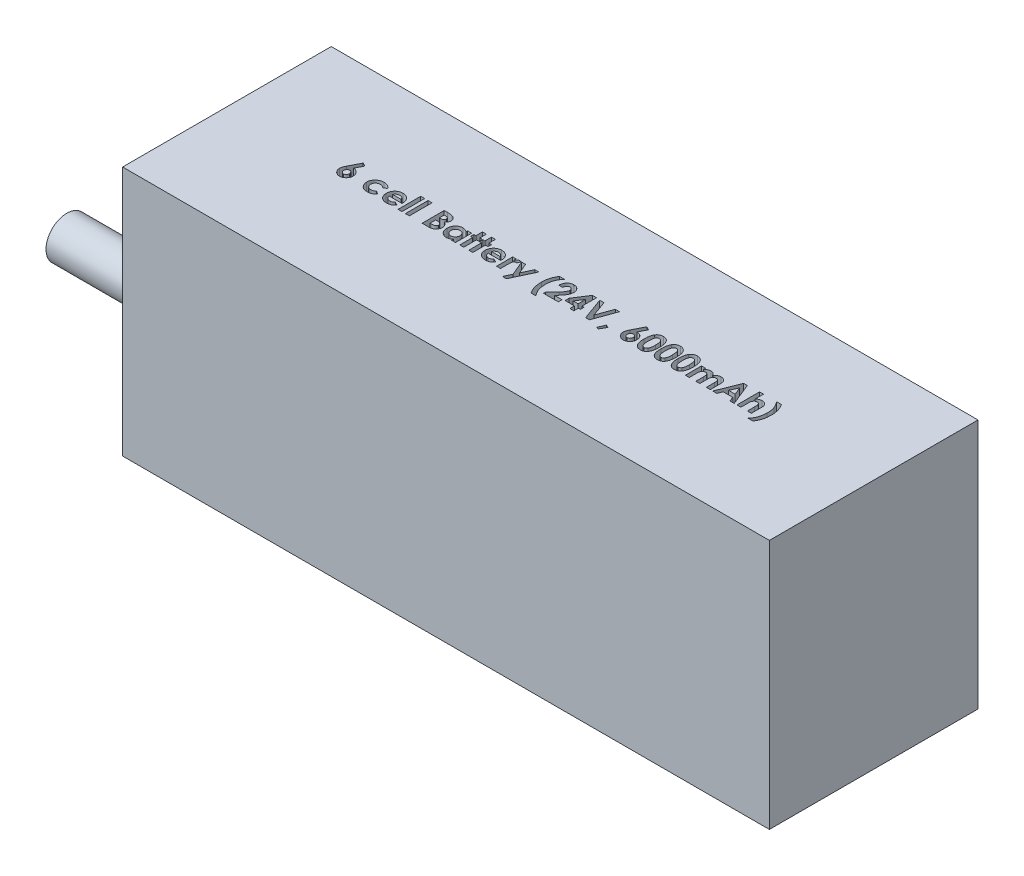
from build123d import *

# Parameters (mm, degrees)
SKETCH1_W           = 155
SKETCH1_H           = 50
BOSS_EXTRUDE1_DEPTH = 60
SKETCH2_R           = 2.5
SKETCH2_R_2         = 5
BOSS_EXTRUDE2_DEPTH = 20
SKETCH3_W           = 0.949786325
SKETCH3_H           = 5.427350427
CUT_EXTRUDE1_DEPTH  = 5


with BuildPart() as part:
    # Sketch1 → Boss-Extrude1 (new body)
    with BuildSketch(Plane(origin=(0, 0, 0), x_dir=(1, 0, 0), z_dir=(0, 1, 0))):
        with Locations((77.5, 25)):
            Rectangle(SKETCH1_W, SKETCH1_H)
    extrude(amount=BOSS_EXTRUDE1_DEPTH)

    # Sketch2 → Boss-Extrude2 (add)
    with BuildSketch(Plane.ZY):
        with Locations(Location((-45.450898806, 32.088602431, 0), (0, 0, 180))):
            Circle(SKETCH2_R)
        with Locations(Location((-6.637703625, 32.088602431, 0), (0, 0, 180))):
            Circle(SKETCH2_R_2)
    extrude(amount=BOSS_EXTRUDE2_DEPTH)

    # Sketch3 → Cut-Extrude1 (cut)
    # profile 1 of 25: a face of its own
    with BuildSketch(Plane(origin=(0, 60, 0), x_dir=(1, 0, 0), z_dir=(0, 1, 0))):
        with BuildLine():
            Line((28.001040588, 29.642805953), (28.841643887, 29.216674143))
            Line((28.841643887, 29.216674143), (27.919418326, 27.404023902))
            add(Edge.make_bspline(
                [(27.919418326, 27.404023902), (27.973902547, 27.402613278), (28.081218155, 27.399834823), (28.239111296, 27.377378883), (28.390060079, 27.338557948), (28.535586512, 27.287100904), (28.673911674, 27.217993582), (28.807263367, 27.135786818), (28.932191716, 27.035526827), (29.051561222, 26.924444076), (29.1601033, 26.801380352), (29.254391285, 26.669144471), (29.336561599, 26.530953749), (29.400437494, 26.383716524), (29.451961918, 26.229873419), (29.489139057, 26.068809459), (29.510349656, 25.900058237), (29.51327389, 25.785417887), (29.514762543, 25.727057423)],
                knots=[0, 0, 0, 0, 1.013260694, 1.995783107, 2.958651975, 3.908806537, 4.861209129, 5.829647963, 6.817170299, 7.835534541, 8.860094905, 9.863329007, 10.853101798, 11.844815043, 12.84250023, 13.867713965, 14.914507806, 16, 16, 16, 16], degree=3))
            add(Edge.make_bspline(
                [(29.514762543, 25.727057423), (29.513367552, 25.670801474), (29.510610253, 25.559607589), (29.487817526, 25.39629205), (29.450983281, 25.239600342), (29.398339748, 25.089845396), (29.33142556, 24.946295207), (29.249594041, 24.809034011), (29.152166557, 24.679087516), (29.041660365, 24.557146195), (28.920858034, 24.445995779), (28.793525796, 24.347198821), (28.658584656, 24.265588785), (28.518585158, 24.196667197), (28.370949827, 24.145236761), (28.217888031, 24.106415692), (28.05823906, 24.08401425), (27.949873428, 24.081197243), (27.89503765, 24.079771765)],
                knots=[0, 0, 0, 0, 1.049934834, 2.075270938, 3.072134561, 4.05064612, 5.033440221, 6.024524368, 7.028587226, 8.060776465, 9.092543989, 10.090062252, 11.064205434, 12.031961459, 12.998029633, 13.977230324, 14.976426867, 16, 16, 16, 16], degree=3))
            add(Edge.make_bspline(
                [(27.89503765, 24.079771765), (27.83769609, 24.080941579), (27.724941671, 24.083241859), (27.559953737, 24.108998936), (27.401716109, 24.147772624), (27.251118107, 24.203134862), (27.107223208, 24.273628172), (26.971725514, 24.360856552), (26.843483645, 24.463858108), (26.723864848, 24.580315467), (26.616097226, 24.70787857), (26.519977514, 24.840322283), (26.438660113, 24.977854439), (26.372835573, 25.12032799), (26.32147774, 25.267288937), (26.285743164, 25.419016202), (26.262458789, 25.575107327), (26.259729227, 25.681039597), (26.258352287, 25.734477628)],
                knots=[0, 0, 0, 0, 1.063775006, 2.091769615, 3.092589432, 4.084662827, 5.064601646, 6.061867366, 7.070035304, 8.113879863, 9.156342271, 10.166834137, 11.149076039, 12.117706134, 13.076241869, 14.034148791, 15.008317125, 16, 16, 16, 16], degree=3))
            add(Edge.make_bspline(
                [(26.258352287, 25.734477628), (26.259079835, 25.775859132), (26.260538981, 25.858852486), (26.275202528, 25.983130524), (26.29749627, 26.10773478), (26.323337636, 26.212879797), (26.349946464, 26.301790912), (26.376728454, 26.377033987), (26.409918829, 26.460537347), (26.447860344, 26.552514226), (26.491746122, 26.652853977), (26.541346911, 26.761283099), (26.596786195, 26.8786227), (26.63632204, 26.959216836), (26.656923334, 27.001212738)],
                knots=[0, 0, 0, 0, 1.110454016, 2.227089276, 3.35462975, 4.507227546, 5.131400587, 5.845402449, 6.650387134, 7.543487832, 8.516250726, 9.590168902, 10.744287919, 12, 12, 12, 12], degree=3))
            Line((26.656923334, 27.001212738), (28.001040588, 29.642805953))
        make_face()
        with BuildLine():
            add(Edge.make_bspline(
                [(27.873837063, 26.522079458), (27.828263424, 26.519989091), (27.739081795, 26.515898518), (27.612278857, 26.473060048), (27.496663347, 26.40585715), (27.396446393, 26.312264117), (27.312624132, 26.200416768), (27.251028594, 26.072839927), (27.213975454, 25.931236072), (27.21012587, 25.832229017), (27.208138612, 25.781118921)],
                knots=[0, 0, 0, 0, 0.981744412, 1.921144944, 2.858899012, 3.85339082, 4.86292663, 5.863643845, 6.897155691, 8, 8, 8, 8], degree=3))
            add(Edge.make_bspline(
                [(27.208138612, 25.781118921), (27.210491588, 25.729991805), (27.215068284, 25.630546148), (27.25351467, 25.487593971), (27.316463333, 25.357120008), (27.40474482, 25.243790439), (27.508386016, 25.149718122), (27.623311809, 25.080147146), (27.747605197, 25.037407412), (27.833581968, 25.032192597), (27.877017151, 25.02955809)],
                knots=[0, 0, 0, 0, 1.098279937, 2.136227893, 3.159405121, 4.194678092, 5.206500211, 6.154139736, 7.067477469, 8, 8, 8, 8], degree=3))
            add(Edge.make_bspline(
                [(27.877017151, 25.02955809), (27.922889612, 25.03223952), (28.012853477, 25.037498269), (28.142632252, 25.078439593), (28.261185941, 25.146845027), (28.366010335, 25.240616164), (28.456052497, 25.35265249), (28.518352578, 25.483892839), (28.558576358, 25.627876794), (28.562795102, 25.728892941), (28.564976218, 25.781118921)],
                knots=[0, 0, 0, 0, 0.96921794, 1.900804717, 2.848419905, 3.844199796, 4.861108892, 5.867439427, 6.897452859, 8, 8, 8, 8], degree=3))
            add(Edge.make_bspline(
                [(28.564976218, 25.781118921), (28.562491528, 25.832199174), (28.557679634, 25.931122048), (28.521536613, 26.073389286), (28.457005688, 26.200474399), (28.371286881, 26.312725806), (28.267620991, 26.406277105), (28.147378313, 26.473590031), (28.014782804, 26.515822622), (27.921503976, 26.519963438), (27.873837063, 26.522079458)],
                knots=[0, 0, 0, 0, 1.083229974, 2.097801324, 3.086792542, 4.086858909, 5.079819718, 6.026392613, 6.991456328, 8, 8, 8, 8], degree=3))
        make_face(mode=Mode.SUBTRACT)
    # profile 2 of 25: a face of its own
    with BuildSketch(Plane(origin=(0, 60, 0), x_dir=(1, 0, 0), z_dir=(0, 1, 0))):
        with BuildLine():
            Line((36.231108697, 27.293780847), (35.444566897, 26.861288859))
            add(Edge.make_bspline(
                [(35.444566897, 26.861288859), (35.408514687, 26.897391971), (35.339213277, 26.966791227), (35.228082896, 27.054639676), (35.118938269, 27.127375748), (35.007279814, 27.181051233), (34.892109438, 27.221474018), (34.769273085, 27.248246916), (34.637337039, 27.265875918), (34.546076726, 27.267501798), (34.49902069, 27.268340142)],
                knots=[0, 0, 0, 0, 1.150764855, 2.212059359, 3.192108068, 4.105322427, 5.000809612, 5.941206042, 6.938435785, 8, 8, 8, 8], degree=3))
            add(Edge.make_bspline(
                [(34.49902069, 27.268340142), (34.455867057, 27.267297822), (34.371419017, 27.26525809), (34.248027028, 27.250022692), (34.130755588, 27.226093691), (34.019815204, 27.191085479), (33.915403473, 27.144837726), (33.816656953, 27.090110466), (33.724535203, 27.024766128), (33.640340387, 26.949733563), (33.564339767, 26.867124373), (33.496543337, 26.779018121), (33.44100205, 26.684107772), (33.392983162, 26.584624064), (33.357679091, 26.478698471), (33.331849773, 26.367292155), (33.317127303, 26.250400183), (33.314994277, 26.170542995), (33.313907842, 26.129868587)],
                knots=[0, 0, 0, 0, 1.121765476, 2.195200973, 3.227634963, 4.230038321, 5.213228299, 6.192116585, 7.160777141, 8.14345191, 9.118668839, 10.075979138, 11.027630062, 11.972829041, 12.943187208, 13.923755399, 14.94248691, 16, 16, 16, 16], degree=3))
            add(Edge.make_bspline(
                [(33.313907842, 26.129868587), (33.315055754, 26.090255647), (33.317297131, 26.012908575), (33.331067402, 25.899267293), (33.35497311, 25.791085643), (33.39081659, 25.688935549), (33.433779007, 25.59187533), (33.487731939, 25.500676928), (33.551177614, 25.414942101), (33.624450048, 25.335416011), (33.705617312, 25.263892049), (33.793121986, 25.200728986), (33.886702994, 25.147178395), (33.987450459, 25.105153215), (34.093721797, 25.070911486), (34.206226691, 25.046530034), (34.324845417, 25.032996641), (34.405704799, 25.030721992), (34.44707925, 25.02955809)],
                knots=[0, 0, 0, 0, 1.070556293, 2.090336998, 3.088792742, 4.058148387, 5.011235098, 5.952916408, 6.915475435, 7.888633318, 8.869583867, 9.83422472, 10.800707077, 11.776204622, 12.778807041, 13.814557445, 14.881744048, 16, 16, 16, 16], degree=3))
            add(Edge.make_bspline(
                [(34.44707925, 25.02955809), (34.498021116, 25.030723789), (34.597452234, 25.032999064), (34.741996226, 25.052297213), (34.878010143, 25.084209565), (35.005508412, 25.128378796), (35.124312658, 25.186130888), (35.234117624, 25.25667076), (35.336052102, 25.339478049), (35.395494673, 25.404036477), (35.425486368, 25.436609372)],
                knots=[0, 0, 0, 0, 1.116373375, 2.178998604, 3.189797796, 4.174590301, 5.13072713, 6.078291395, 7.030403691, 8, 8, 8, 8], degree=3))
            Line((35.425486368, 25.436609372), (36.163266817, 24.929915328))
            add(Edge.make_bspline(
                [(36.163266817, 24.929915328), (36.11212742, 24.867390949), (36.011207708, 24.74400384), (35.835130797, 24.584962361), (35.645618858, 24.448310391), (35.438860396, 24.339236521), (35.217866499, 24.252482201), (34.980910311, 24.191155509), (34.728392627, 24.155055099), (34.554967924, 24.150133779), (34.466159779, 24.147613646)],
                knots=[0, 0, 0, 0, 0.997876357, 1.969233105, 2.924898516, 3.881013542, 4.852507933, 5.855329832, 6.901747111, 8, 8, 8, 8], degree=3))
            add(Edge.make_bspline(
                [(34.466159779, 24.147613646), (34.38622694, 24.149461456), (34.230109292, 24.153070433), (34.002571699, 24.180708386), (33.788560778, 24.227260755), (33.587636275, 24.291912429), (33.399981375, 24.375660555), (33.226204659, 24.479539523), (33.065134008, 24.6006598), (32.919675781, 24.739593551), (32.789893668, 24.890824439), (32.676593415, 25.05009461), (32.578606173, 25.214550404), (32.501735278, 25.386929127), (32.438910571, 25.564543963), (32.396480735, 25.749518043), (32.368495645, 25.940327714), (32.365591296, 26.069698987), (32.364121518, 26.135168734)],
                knots=[0, 0, 0, 0, 1.183377041, 2.311265848, 3.387807024, 4.421911742, 5.431260577, 6.423665966, 7.413571885, 8.409103097, 9.395976332, 10.359992013, 11.300391101, 12.225292883, 13.150239058, 14.085544813, 15.031169026, 16, 16, 16, 16], degree=3))
            add(Edge.make_bspline(
                [(32.364121518, 26.135168734), (32.364908888, 26.180782062), (32.366468428, 26.27112804), (32.379781961, 26.405301892), (32.400493345, 26.537198868), (32.43162011, 26.665893119), (32.469900536, 26.792009024), (32.516435577, 26.915521231), (32.573060748, 27.035792396), (32.636226297, 27.153845618), (32.708217432, 27.266564467), (32.786758267, 27.373899192), (32.871738145, 27.47519242), (32.964155364, 27.569500124), (33.063365534, 27.657497114), (33.167926395, 27.740968685), (33.281221486, 27.815610018), (33.399312231, 27.885786658), (33.523215863, 27.948257383), (33.651508276, 28.002177855), (33.783198057, 28.047991073), (33.918600861, 28.084825825), (34.057135511, 28.115184413), (34.20003472, 28.134451221), (34.346116238, 28.147993447), (34.444927032, 28.149516269), (34.494780572, 28.150284586)],
                knots=[0, 0, 0, 0, 1.00272354, 1.986087015, 2.96193297, 3.936200312, 4.894695956, 5.858592327, 6.835334787, 7.815655071, 8.800643866, 9.773423113, 10.738352213, 11.705312252, 12.673769326, 13.65298065, 14.64420052, 15.654211674, 16.672258995, 17.692438602, 18.712115155, 19.735602823, 20.776372304, 21.827874031, 22.90408564, 24, 24, 24, 24], degree=3))
            add(Edge.make_bspline(
                [(34.494780572, 28.150284586), (34.541088115, 28.14976104), (34.63241638, 28.148728496), (34.767287583, 28.137931816), (34.898479774, 28.119593181), (35.026216218, 28.095331939), (35.150884848, 28.065268035), (35.270814773, 28.025193858), (35.387645638, 27.979711177), (35.538125027, 27.911037077), (35.715512685, 27.808529867), (35.910236808, 27.661511931), (36.083856937, 27.489522389), (36.181763891, 27.359374823), (36.231108697, 27.293780847)],
                knots=[0, 0, 0, 0, 0.826738014, 1.630502179, 2.413926014, 3.191023582, 3.95155221, 4.701751672, 5.446919844, 6.189438973, 7.653650558, 9.094719814, 10.535747635, 12, 12, 12, 12], degree=3))
        make_face()
    # profile 3 of 25: a face of its own
    with BuildSketch(Plane(origin=(0, 60, 0), x_dir=(1, 0, 0), z_dir=(0, 1, 0))):
        with BuildLine():
            Line((41.044702113, 25.911502535), (37.994997586, 25.911502535))
            add(Edge.make_bspline(
                [(37.994997586, 25.911502535), (38.001215687, 25.876066698), (38.013434747, 25.806432484), (38.039968869, 25.705282745), (38.073830389, 25.609960939), (38.114411287, 25.520339643), (38.161027372, 25.435945064), (38.215401172, 25.357173047), (38.276843006, 25.284093168), (38.344997634, 25.21702304), (38.418729041, 25.156926751), (38.497679658, 25.104278603), (38.581930957, 25.061110343), (38.670517028, 25.024723978), (38.764099813, 24.995902292), (38.862817042, 24.976024523), (38.966407032, 24.964282651), (39.036975697, 24.962584324), (39.073047466, 24.96171621)],
                knots=[0, 0, 0, 0, 1.091296461, 2.144483647, 3.168565212, 4.157007626, 5.126487748, 6.090021542, 7.05641414, 8.019231907, 8.98705074, 9.938580405, 10.892824166, 11.854447369, 12.841318655, 13.858982407, 14.905600794, 16, 16, 16, 16], degree=3))
            add(Edge.make_bspline(
                [(39.073047466, 24.96171621), (39.116588539, 24.962865736), (39.202333736, 24.965129492), (39.327951087, 24.985205646), (39.449441363, 25.015529794), (39.56565484, 25.060624346), (39.677937667, 25.116759138), (39.784441324, 25.18669618), (39.887009306, 25.268391686), (39.949587862, 25.33136255), (39.981492645, 25.363467345)],
                knots=[0, 0, 0, 0, 1.021034703, 2.010718019, 2.977989445, 3.954245119, 4.929443971, 5.918328161, 6.938689359, 8, 8, 8, 8], degree=3))
            Line((39.981492645, 25.363467345), (40.77651468, 24.985036856))
            add(Edge.make_bspline(
                [(40.77651468, 24.985036856), (40.751483875, 24.950448126), (40.701886256, 24.881911828), (40.620919807, 24.785463557), (40.536426162, 24.695473406), (40.448342306, 24.612533257), (40.356556526, 24.536879454), (40.261324148, 24.467590399), (40.16125339, 24.406526473), (40.058345148, 24.350733443), (39.950472119, 24.302902336), (39.837932836, 24.262113657), (39.721203964, 24.225241038), (39.598811471, 24.197146122), (39.471774518, 24.174906416), (39.339789208, 24.159113279), (39.202872935, 24.149358614), (39.109811742, 24.148202211), (39.062447172, 24.147613646)],
                knots=[0, 0, 0, 0, 1.028154879, 2.037251081, 3.030720504, 4.000128189, 4.949298328, 5.894184978, 6.834267904, 7.770992897, 8.712077017, 9.673380525, 10.653304757, 11.658697181, 12.695551717, 13.758623199, 14.859225354, 16, 16, 16, 16], degree=3))
            add(Edge.make_bspline(
                [(39.062447172, 24.147613646), (38.989577558, 24.149099238), (38.846866619, 24.152008685), (38.638126073, 24.179012514), (38.43988045, 24.223787773), (38.251569975, 24.284652862), (38.07400865, 24.365013846), (37.9071086, 24.463301997), (37.749202254, 24.577632932), (37.605114534, 24.710406155), (37.47384637, 24.854921914), (37.358548577, 25.010121972), (37.262069025, 25.174922002), (37.182838076, 25.348231326), (37.121257031, 25.530493545), (37.076860669, 25.721788197), (37.049645167, 25.922023914), (37.046705758, 26.05840679), (37.045211261, 26.127748528)],
                knots=[0, 0, 0, 0, 1.103565453, 2.161269334, 3.182010356, 4.179077853, 5.15417608, 6.128274628, 7.109042802, 8.101804412, 9.090965879, 10.063106201, 11.02526161, 11.978650795, 12.945248442, 13.93468508, 14.949922959, 16, 16, 16, 16], degree=3))
            add(Edge.make_bspline(
                [(37.045211261, 26.127748528), (37.046720467, 26.198852329), (37.049689761, 26.338745864), (37.076626344, 26.543605116), (37.121379771, 26.739068551), (37.183140955, 26.925405342), (37.26116996, 27.103198272), (37.358877049, 27.270891864), (37.473789154, 27.429069938), (37.604584427, 27.576992519), (37.749282547, 27.71050881), (37.903037971, 27.829498507), (38.067578297, 27.928648621), (38.241042434, 28.008761852), (38.422320842, 28.073851829), (38.613508846, 28.117163773), (38.813151796, 28.146245151), (38.949623321, 28.148923365), (39.018985967, 28.150284586)],
                knots=[0, 0, 0, 0, 1.079208495, 2.12329425, 3.130605359, 4.119693003, 5.099659317, 6.073216462, 7.060498243, 8.06384408, 9.066070512, 10.045757761, 11.010926815, 11.975797609, 12.942977511, 13.929384301, 14.947594487, 16, 16, 16, 16], degree=3))
            add(Edge.make_bspline(
                [(39.018985967, 28.150284586), (39.092204676, 28.148775946), (39.235962065, 28.145813887), (39.446156425, 28.119029322), (39.645718375, 28.073981029), (39.83549816, 28.013642229), (40.013072215, 27.931251242), (40.18234238, 27.835381807), (40.339248597, 27.718579522), (40.485463318, 27.586456049), (40.617451987, 27.439869634), (40.732824708, 27.280631891), (40.830992694, 27.110296887), (40.910558821, 26.928173878), (40.972076634, 26.734809614), (41.016514092, 26.530455216), (41.043522005, 26.31433342), (41.046406718, 26.166342439), (41.047882201, 26.0906475)],
                knots=[0, 0, 0, 0, 1.080001299, 2.120471247, 3.119684163, 4.095710327, 5.052285597, 6.002875087, 6.961153713, 7.931888285, 8.906493152, 9.865905668, 10.82813294, 11.801621613, 12.7925306, 13.817193356, 14.883530496, 16, 16, 16, 16], degree=3))
            Line((41.047882201, 26.0906475), (41.044702113, 25.911502535))
        make_face()
        with BuildLine():
            add(Edge.make_bspline(
                [(40.098095877, 26.657763218), (40.080172828, 26.706130267), (40.044537138, 26.802296559), (39.964037597, 26.934982578), (39.857217282, 27.049894058), (39.732977592, 27.151626104), (39.591025967, 27.234198186), (39.435835552, 27.293983056), (39.269367922, 27.329830813), (39.154847163, 27.334035126), (39.096368112, 27.336182022)],
                knots=[0, 0, 0, 0, 0.954238005, 1.897273737, 2.851915805, 3.847685534, 4.862635127, 5.880135777, 6.917509367, 8, 8, 8, 8], degree=3))
            add(Edge.make_bspline(
                [(39.096368112, 27.336182022), (39.032499467, 27.334119667), (38.907649564, 27.330088191), (38.72756208, 27.287211974), (38.557690062, 27.2232205), (38.457543148, 27.157243931), (38.407349015, 27.124176146)],
                knots=[0, 0, 0, 0, 1.044195649, 2.041185066, 3.018232172, 4, 4, 4, 4], degree=3))
            add(Edge.make_bspline(
                [(38.407349015, 27.124176146), (38.376031625, 27.098990996), (38.309264549, 27.045297544), (38.222553956, 26.938184205), (38.1371433, 26.808493997), (38.088582633, 26.709985121), (38.062839466, 26.657763218)],
                knots=[0, 0, 0, 0, 0.82159062, 1.751589201, 2.808063854, 4, 4, 4, 4], degree=3))
            Line((38.062839466, 26.657763218), (40.098095877, 26.657763218))
        make_face(mode=Mode.SUBTRACT)
    # profile 4 of 25: a face of its own
    with BuildSketch(Plane(origin=(0, 60, 0), x_dir=(1, 0, 0), z_dir=(0, 1, 0))):
        with Locations((42.269036048, 26.92913074)):
            Rectangle(SKETCH3_W, SKETCH3_H)
    # profile 5 of 25: a face of its own
    with BuildSketch(Plane(origin=(0, 60, 0), x_dir=(1, 0, 0), z_dir=(0, 1, 0))):
        with Locations((44.032924937, 26.92913074)):
            Rectangle(SKETCH3_W, SKETCH3_H)
    # profile 6 of 25: a face of its own
    with BuildSketch(Plane(origin=(0, 60, 0), x_dir=(1, 0, 0), z_dir=(0, 1, 0))):
        with BuildLine():
            Line((47.560702714, 24.215455526), (47.560702714, 29.507122193))
            Line((47.560702714, 29.507122193), (48.408726218, 29.507122193))
            add(Edge.make_bspline(
                [(48.408726218, 29.507122193), (48.468093166, 29.507128968), (48.582967085, 29.507142078), (48.74870017, 29.501322076), (48.902403609, 29.493793252), (49.04358826, 29.485370248), (49.172494427, 29.47085573), (49.288926089, 29.455559013), (49.393115875, 29.437112115), (49.457530759, 29.420564677), (49.487836128, 29.412779578)],
                knots=[0, 0, 0, 0, 1.311965854, 2.538629056, 3.664479157, 4.713267157, 5.663616078, 6.530575999, 7.308677837, 8, 8, 8, 8], degree=3))
            add(Edge.make_bspline(
                [(49.487836128, 29.412779578), (49.527630154, 29.401798557), (49.605718809, 29.38025027), (49.717566682, 29.336732572), (49.823669992, 29.288359565), (49.92389919, 29.233175011), (50.017638827, 29.170512678), (50.104532661, 29.09987526), (50.186454778, 29.024098138), (50.26049631, 28.941069426), (50.327417656, 28.853334212), (50.385560307, 28.760915484), (50.436078819, 28.665226385), (50.476506861, 28.565062733), (50.506968631, 28.460885806), (50.529248242, 28.353140457), (50.543688447, 28.241485754), (50.545052857, 28.16552341), (50.545745449, 28.12696394)],
                knots=[0, 0, 0, 0, 1.099996261, 2.158545794, 3.195537121, 4.207578794, 5.205712374, 6.197378256, 7.190519799, 8.17788031, 9.159561366, 10.129234751, 11.085776129, 12.040971148, 13.00380137, 13.975669004, 14.972423361, 16, 16, 16, 16], degree=3))
            add(Edge.make_bspline(
                [(50.545745449, 28.12696394), (50.543934526, 28.077425142), (50.540369947, 27.979914105), (50.517599174, 27.836688034), (50.474900425, 27.701318811), (50.419030151, 27.571311631), (50.343064046, 27.447151423), (50.246601785, 27.328897221), (50.131205739, 27.212907802), (50.042690602, 27.143379968), (49.99665023, 27.107215676)],
                knots=[0, 0, 0, 0, 0.986156485, 1.941127874, 2.875419072, 3.804401753, 4.751181392, 5.761612777, 6.835722519, 8, 8, 8, 8], degree=3))
            add(Edge.make_bspline(
                [(49.99665023, 27.107215676), (50.033959139, 27.088169801), (50.107111587, 27.050826111), (50.210966573, 26.989444232), (50.307124952, 26.924156818), (50.396017872, 26.85627748), (50.475780699, 26.782928712), (50.549706977, 26.708336973), (50.614149566, 26.628228465), (50.671776071, 26.545458409), (50.721864093, 26.458828284), (50.765485236, 26.368484389), (50.802330452, 26.27411809), (50.833531933, 26.176209634), (50.856802006, 26.074422263), (50.871974588, 25.968719573), (50.883591666, 25.859462064), (50.884495365, 25.785038577), (50.884954851, 25.747197981)],
                knots=[0, 0, 0, 0, 1.164658916, 2.283573913, 3.35186032, 4.395461096, 5.390182219, 6.362969632, 7.312859996, 8.245001507, 9.165155236, 10.092416118, 11.032087915, 11.979892451, 12.947605196, 13.931445124, 14.948243989, 16, 16, 16, 16], degree=3))
            add(Edge.make_bspline(
                [(50.884954851, 25.747197981), (50.881973096, 25.674924606), (50.876088615, 25.53229339), (50.833064158, 25.322878008), (50.758473422, 25.124333232), (50.658313444, 24.937448163), (50.53489708, 24.767632819), (50.393003653, 24.618876051), (50.234061705, 24.49295675), (50.087418547, 24.40797099), (49.960583764, 24.350937597), (49.855528883, 24.315675958), (49.742702167, 24.283009628), (49.620036903, 24.260070657), (49.489756843, 24.239074388), (49.35059175, 24.226110857), (49.20280172, 24.217325791), (49.10129314, 24.216091552), (49.048983964, 24.215455526)],
                knots=[0, 0, 0, 0, 1.284142165, 2.534249414, 3.780121997, 5.041676246, 6.291546858, 7.49970053, 8.684500223, 9.883330709, 10.50184324, 11.153274765, 11.851151195, 12.587658647, 13.369265475, 14.195992086, 15.070362669, 16, 16, 16, 16], degree=3))
            Line((49.048983964, 24.215455526), (47.560702714, 24.215455526))
        make_face()
        with BuildLine():
            Line((48.510489039, 28.557335868), (48.510489039, 27.404023902))
            Line((48.510489039, 27.404023902), (48.762776032, 27.404023902))
            add(Edge.make_bspline(
                [(48.762776032, 27.404023902), (48.797064101, 27.404322907), (48.863255143, 27.404900118), (48.958861082, 27.412334394), (49.047759165, 27.425017732), (49.129612222, 27.442714178), (49.205182743, 27.465186084), (49.273987962, 27.492224627), (49.335725355, 27.525214588), (49.407449926, 27.574354591), (49.483267971, 27.646666306), (49.550009742, 27.75113556), (49.5893202, 27.871274805), (49.593698325, 27.956006303), (49.595959124, 27.999760414)],
                knots=[0, 0, 0, 0, 1.065314748, 2.056525647, 2.977365736, 3.853934255, 4.656397591, 5.425096493, 6.14721249, 6.826394842, 8.123232004, 9.372140726, 10.643011755, 12, 12, 12, 12], degree=3))
            add(Edge.make_bspline(
                [(49.595959124, 27.999760414), (49.594150071, 28.040743409), (49.590652338, 28.119982382), (49.551071761, 28.231240958), (49.489595301, 28.329838826), (49.417013698, 28.397321004), (49.348664015, 28.443409341), (49.290138823, 28.473756549), (49.225903029, 28.500923059), (49.154713099, 28.521695235), (49.076975564, 28.537281945), (48.993068041, 28.548728516), (48.90284576, 28.556519539), (48.840529038, 28.557057922), (48.808357295, 28.557335868)],
                knots=[0, 0, 0, 0, 1.347982417, 2.606269829, 3.849316587, 5.153353503, 5.842674298, 6.568177932, 7.326619318, 8.142485038, 9.012069166, 9.942760135, 10.937925643, 12, 12, 12, 12], degree=3))
            Line((48.808357295, 28.557335868), (48.510489039, 28.557335868))
        make_face(mode=Mode.SUBTRACT)
        with BuildLine():
            Line((48.510489039, 26.522079458), (48.510489039, 25.165241851))
            Line((48.510489039, 25.165241851), (48.783976619, 25.165241851))
            add(Edge.make_bspline(
                [(48.783976619, 25.165241851), (48.838045462, 25.165550744), (48.941999559, 25.16614463), (49.090913619, 25.173320184), (49.226313728, 25.186252856), (49.347841127, 25.202398254), (49.455681959, 25.224272744), (49.549471694, 25.252083355), (49.630496538, 25.28267987), (49.698270662, 25.3204702), (49.753638239, 25.364448772), (49.803601672, 25.409395929), (49.844338742, 25.461246721), (49.876570672, 25.517775338), (49.904467351, 25.577577567), (49.921292657, 25.642988665), (49.934102855, 25.712070002), (49.934807835, 25.759852069), (49.935168526, 25.784299009)],
                knots=[0, 0, 0, 0, 1.753078804, 3.370512758, 4.83203934, 6.162291463, 7.344201807, 8.395507345, 9.331626367, 10.147333109, 10.898971645, 11.62040215, 12.321813352, 13.025280112, 13.727906689, 14.453419512, 15.208716525, 16, 16, 16, 16], degree=3))
            add(Edge.make_bspline(
                [(49.935168526, 25.784299009), (49.934373098, 25.812254469), (49.932823817, 25.866704185), (49.920170822, 25.946288257), (49.897176197, 26.020585267), (49.868213345, 26.091495093), (49.827909997, 26.156478914), (49.780010846, 26.217785574), (49.722136443, 26.273339041), (49.657053301, 26.326499396), (49.581140259, 26.373044167), (49.494361702, 26.41343), (49.3962462, 26.44715876), (49.286489832, 26.474013622), (49.165573759, 26.496804971), (49.032615428, 26.510413923), (48.888722162, 26.520535498), (48.788944229, 26.52155311), (48.737335326, 26.522079458)],
                knots=[0, 0, 0, 0, 0.845221588, 1.646264278, 2.427170338, 3.19324141, 3.95557735, 4.731569926, 5.540061037, 6.376114724, 7.268642756, 8.224665384, 9.265483498, 10.400594375, 11.639216012, 12.983232105, 14.439614077, 16, 16, 16, 16], degree=3))
            Line((48.737335326, 26.522079458), (48.510489039, 26.522079458))
        make_face(mode=Mode.SUBTRACT)
    # profile 7 of 25: a face of its own
    with BuildSketch(Plane(origin=(0, 60, 0), x_dir=(1, 0, 0), z_dir=(0, 1, 0))):
        with BuildLine():
            Line((54.61625827, 28.082442706), (55.566044595, 28.082442706))
            Line((55.566044595, 28.082442706), (55.566044595, 24.215455526))
            Line((55.566044595, 24.215455526), (54.61625827, 24.215455526))
            Line((54.61625827, 24.215455526), (54.61625827, 24.63734722))
            add(Edge.make_bspline(
                [(54.61625827, 24.63734722), (54.569196707, 24.596280733), (54.477859508, 24.516578791), (54.333941638, 24.413163496), (54.189603222, 24.327859242), (54.044150713, 24.259919057), (53.895348564, 24.209752223), (53.74212546, 24.173430263), (53.582274827, 24.152010314), (53.473610568, 24.149094468), (53.41842507, 24.147613646)],
                knots=[0, 0, 0, 0, 1.129196829, 2.191548051, 3.199897424, 4.157751732, 5.089409408, 6.034969131, 7.002052659, 8, 8, 8, 8], degree=3))
            add(Edge.make_bspline(
                [(53.41842507, 24.147613646), (53.356476895, 24.149007286), (53.23406379, 24.151761198), (53.054436149, 24.180750565), (52.880987803, 24.225125252), (52.713859544, 24.287920982), (52.553355448, 24.369291936), (52.398247171, 24.467115034), (52.251193741, 24.58482445), (52.11097099, 24.717327199), (51.982583879, 24.863081166), (51.870346656, 25.020063306), (51.775739017, 25.186047173), (51.698232042, 25.360482454), (51.637262797, 25.543241125), (51.593800449, 25.734902839), (51.568157614, 25.935536049), (51.564983754, 26.072199535), (51.563373654, 26.14152891)],
                knots=[0, 0, 0, 0, 0.980476535, 1.937477201, 2.874147792, 3.812856188, 4.758993464, 5.720109578, 6.712210464, 7.737600662, 8.772720504, 9.783789959, 10.789002326, 11.793715968, 12.802552247, 13.835794126, 14.902098527, 16, 16, 16, 16], degree=3))
            add(Edge.make_bspline(
                [(51.563373654, 26.14152891), (51.565063459, 26.21331957), (51.5683782, 26.354144948), (51.592625332, 26.560799494), (51.635285636, 26.757213445), (51.693456027, 26.943658862), (51.768282134, 27.120167956), (51.859415332, 27.287029904), (51.968095404, 27.443808558), (52.093329921, 27.587835433), (52.22855244, 27.719843022), (52.37321663, 27.834766096), (52.525060259, 27.932398594), (52.684244689, 28.012104601), (52.850747186, 28.07369737), (53.023910401, 28.118726713), (53.204503058, 28.1457459), (53.327524239, 28.148759126), (53.389804277, 28.150284586)],
                knots=[0, 0, 0, 0, 1.136281865, 2.228943489, 3.287578264, 4.313574083, 5.316051562, 6.317280042, 7.318008486, 8.329309503, 9.333984563, 10.305318864, 11.248632312, 12.186624717, 13.117503092, 14.05354244, 15.014596925, 16, 16, 16, 16], degree=3))
            add(Edge.make_bspline(
                [(53.389804277, 28.150284586), (53.447495772, 28.149086033), (53.561646445, 28.146714529), (53.729431488, 28.120964533), (53.89215878, 28.082019491), (54.048940636, 28.026529818), (54.201063032, 27.956462817), (54.345909368, 27.868663641), (54.486648287, 27.766822452), (54.572521156, 27.687282326), (54.61625827, 27.64677063)],
                knots=[0, 0, 0, 0, 1.017011718, 2.012299608, 2.98747302, 3.965332399, 4.941441765, 5.936729654, 6.94912688, 8, 8, 8, 8], degree=3))
            Line((54.61625827, 27.64677063), (54.61625827, 28.082442706))
        make_face()
        with BuildLine():
            add(Edge.make_bspline(
                [(53.5890898, 27.268340142), (53.551243615, 27.26717889), (53.477067563, 27.264902913), (53.367981528, 27.25121275), (53.263728002, 27.227090074), (53.165050515, 27.191454), (53.070478408, 27.148044071), (52.981447774, 27.093673848), (52.897223817, 27.0294094), (52.818301866, 26.956806568), (52.74635288, 26.877002781), (52.684328654, 26.789919559), (52.631618082, 26.697903301), (52.587038638, 26.600677343), (52.55512987, 26.497091204), (52.52985814, 26.38849339), (52.516743747, 26.273996712), (52.514366521, 26.19597077), (52.513159979, 26.156369322)],
                knots=[0, 0, 0, 0, 1.04836806, 2.054732945, 3.03993516, 4.00574415, 4.955904794, 5.917688631, 6.888591924, 7.88601754, 8.884115178, 9.859153345, 10.841239365, 11.818093293, 12.814750328, 13.83810466, 14.90274714, 16, 16, 16, 16], degree=3))
            add(Edge.make_bspline(
                [(52.513159979, 26.156369322), (52.514348091, 26.116408665), (52.516689252, 26.037666653), (52.530070186, 25.922204155), (52.554432536, 25.812019982), (52.589976286, 25.708004898), (52.633383449, 25.608755396), (52.686219728, 25.51472952), (52.751119842, 25.427589767), (52.8231319, 25.345274116), (52.903672922, 25.271769435), (52.988373453, 25.206504027), (53.078390433, 25.151896502), (53.172747244, 25.107762355), (53.271126275, 25.071796734), (53.374760901, 25.047977231), (53.48263589, 25.032749873), (53.556177119, 25.030629365), (53.593329918, 25.02955809)],
                knots=[0, 0, 0, 0, 1.099136573, 2.165835871, 3.191374663, 4.196217796, 5.183857741, 6.167377911, 7.154730987, 8.166690795, 9.170734848, 10.148332609, 11.103258353, 12.059567475, 13.009337315, 13.978056681, 14.978520572, 16, 16, 16, 16], degree=3))
            add(Edge.make_bspline(
                [(53.593329918, 25.02955809), (53.631881032, 25.030725852), (53.707462174, 25.0330153), (53.818327893, 25.046580525), (53.923981917, 25.070791649), (54.02398467, 25.106631747), (54.119863596, 25.14973008), (54.210753477, 25.203037867), (54.295668018, 25.267154846), (54.375037275, 25.340414009), (54.447763898, 25.420869442), (54.510645869, 25.509094622), (54.565418367, 25.602267866), (54.608494417, 25.702592129), (54.642702841, 25.808312205), (54.667246596, 25.920084215), (54.680596976, 26.038028663), (54.682917661, 26.118530344), (54.68410015, 26.15954941)],
                knots=[0, 0, 0, 0, 1.050008698, 2.058587853, 3.036635738, 3.995319155, 4.947022481, 5.895997462, 6.858296291, 7.838991643, 8.833936038, 9.806048392, 10.784806122, 11.771666913, 12.772873988, 13.80724452, 14.882696879, 16, 16, 16, 16], degree=3))
            add(Edge.make_bspline(
                [(54.68410015, 26.15954941), (54.682932355, 26.199862966), (54.680651312, 26.278607054), (54.66718902, 26.394088877), (54.642471018, 26.503666195), (54.608966659, 26.607540426), (54.565124274, 26.705474061), (54.510310333, 26.79638125), (54.448118141, 26.883411587), (54.374586329, 26.961693472), (54.295647034, 27.034422183), (54.209483686, 27.096600218), (54.118810899, 27.150186974), (54.023071577, 27.194183767), (53.921379217, 27.226435084), (53.815544638, 27.251406099), (53.703916598, 27.264894696), (53.627990014, 27.267172918), (53.5890898, 27.268340142)],
                knots=[0, 0, 0, 0, 1.106611376, 2.161533483, 3.185006901, 4.184773755, 5.152708835, 6.122342771, 7.094156588, 8.082475533, 9.064254463, 10.03606828, 10.992420271, 11.951521816, 12.920622147, 13.915721683, 14.932141191, 16, 16, 16, 16], degree=3))
        make_face(mode=Mode.SUBTRACT)
    # profile 8 of 25: a face of its own
    with BuildSketch(Plane(origin=(0, 60, 0), x_dir=(1, 0, 0), z_dir=(0, 1, 0))):
        Polygon((56.5836728, 29.642805953), (57.533459124, 29.642805953), (57.533459124, 28.082442706), (58.144036048, 28.082442706), (58.144036048, 27.268340142), (57.533459124, 27.268340142), (57.533459124, 24.215455526), (56.5836728, 24.215455526), (56.5836728, 27.268340142), (56.108779637, 27.268340142), (56.108779637, 28.082442706), (56.5836728, 28.082442706), align=None)
    # profile 9 of 25: a face of its own
    with BuildSketch(Plane(origin=(0, 60, 0), x_dir=(1, 0, 0), z_dir=(0, 1, 0))):
        Polygon((58.754612971, 29.642805953), (59.704399295, 29.642805953), (59.704399295, 28.082442706), (60.314976218, 28.082442706), (60.314976218, 27.268340142), (59.704399295, 27.268340142), (59.704399295, 24.215455526), (58.754612971, 24.215455526), (58.754612971, 27.268340142), (58.279719808, 27.268340142), (58.279719808, 28.082442706), (58.754612971, 28.082442706), align=None)
    # profile 10 of 25: a face of its own
    with BuildSketch(Plane(origin=(0, 60, 0), x_dir=(1, 0, 0), z_dir=(0, 1, 0))):
        with BuildLine():
            Line((64.721518353, 25.911502535), (61.671813825, 25.911502535))
            add(Edge.make_bspline(
                [(61.671813825, 25.911502535), (61.678031927, 25.876066698), (61.690250986, 25.806432484), (61.716785108, 25.705282745), (61.750646628, 25.609960939), (61.791227527, 25.520339643), (61.837843611, 25.435945064), (61.892217411, 25.357173047), (61.953659246, 25.284093168), (62.021813873, 25.21702304), (62.095545281, 25.156926751), (62.174495898, 25.104278603), (62.258747196, 25.061110343), (62.347333267, 25.024723978), (62.440916052, 24.995902292), (62.539633282, 24.976024523), (62.643223271, 24.964282651), (62.713791936, 24.962584324), (62.749863705, 24.96171621)],
                knots=[0, 0, 0, 0, 1.091296461, 2.144483647, 3.168565212, 4.157007626, 5.126487748, 6.090021542, 7.05641414, 8.019231907, 8.98705074, 9.938580405, 10.892824166, 11.854447369, 12.841318655, 13.858982407, 14.905600794, 16, 16, 16, 16], degree=3))
            add(Edge.make_bspline(
                [(62.749863705, 24.96171621), (62.793404779, 24.962865736), (62.879149975, 24.965129492), (63.004767326, 24.985205646), (63.126257603, 25.015529794), (63.242471079, 25.060624346), (63.354753906, 25.116759138), (63.461257563, 25.18669618), (63.563825545, 25.268391686), (63.626404101, 25.33136255), (63.658308884, 25.363467345)],
                knots=[0, 0, 0, 0, 1.021034703, 2.010718019, 2.977989445, 3.954245119, 4.929443971, 5.918328161, 6.938689359, 8, 8, 8, 8], degree=3))
            Line((63.658308884, 25.363467345), (64.453330919, 24.985036856))
            add(Edge.make_bspline(
                [(64.453330919, 24.985036856), (64.428300115, 24.950448126), (64.378702495, 24.881911828), (64.297736047, 24.785463557), (64.213242402, 24.695473406), (64.125158545, 24.612533257), (64.033372765, 24.536879454), (63.938140387, 24.467590399), (63.838069629, 24.406526473), (63.735161387, 24.350733443), (63.627288359, 24.302902336), (63.514749075, 24.262113657), (63.398020203, 24.225241038), (63.275627711, 24.197146122), (63.148590758, 24.174906416), (63.016605447, 24.159113279), (62.879689175, 24.149358614), (62.786627982, 24.148202211), (62.739263411, 24.147613646)],
                knots=[0, 0, 0, 0, 1.028154879, 2.037251081, 3.030720504, 4.000128189, 4.949298328, 5.894184978, 6.834267904, 7.770992897, 8.712077017, 9.673380525, 10.653304757, 11.658697181, 12.695551717, 13.758623199, 14.859225354, 16, 16, 16, 16], degree=3))
            add(Edge.make_bspline(
                [(62.739263411, 24.147613646), (62.666393797, 24.149099238), (62.523682859, 24.152008685), (62.314942312, 24.179012514), (62.11669669, 24.223787773), (61.928386214, 24.284652862), (61.750824889, 24.365013846), (61.583924839, 24.463301997), (61.426018494, 24.577632932), (61.281930774, 24.710406155), (61.150662609, 24.854921914), (61.035364816, 25.010121972), (60.938885264, 25.174922002), (60.859654316, 25.348231326), (60.79807327, 25.530493545), (60.753676908, 25.721788197), (60.726461407, 25.922023914), (60.723521997, 26.05840679), (60.722027501, 26.127748528)],
                knots=[0, 0, 0, 0, 1.103565453, 2.161269334, 3.182010356, 4.179077853, 5.15417608, 6.128274628, 7.109042802, 8.101804412, 9.090965879, 10.063106201, 11.02526161, 11.978650795, 12.945248442, 13.93468508, 14.949922959, 16, 16, 16, 16], degree=3))
            add(Edge.make_bspline(
                [(60.722027501, 26.127748528), (60.723536706, 26.198852329), (60.726506001, 26.338745864), (60.753442583, 26.543605116), (60.798196011, 26.739068551), (60.859957194, 26.925405342), (60.937986199, 27.103198272), (61.035693288, 27.270891864), (61.150605393, 27.429069938), (61.281400667, 27.576992519), (61.426098787, 27.71050881), (61.57985421, 27.829498507), (61.744394537, 27.928648621), (61.917858673, 28.008761852), (62.099137081, 28.073851829), (62.290325085, 28.117163773), (62.489968035, 28.146245151), (62.62643956, 28.148923365), (62.695802207, 28.150284586)],
                knots=[0, 0, 0, 0, 1.079208495, 2.12329425, 3.130605359, 4.119693003, 5.099659317, 6.073216462, 7.060498243, 8.06384408, 9.066070512, 10.045757761, 11.010926815, 11.975797609, 12.942977511, 13.929384301, 14.947594487, 16, 16, 16, 16], degree=3))
            add(Edge.make_bspline(
                [(62.695802207, 28.150284586), (62.769020916, 28.148775946), (62.912778304, 28.145813887), (63.122972664, 28.119029322), (63.322534614, 28.073981029), (63.512314399, 28.013642229), (63.689888454, 27.931251242), (63.859158619, 27.835381807), (64.016064836, 27.718579522), (64.162279558, 27.586456049), (64.294268226, 27.439869634), (64.409640947, 27.280631891), (64.507808933, 27.110296887), (64.58737506, 26.928173878), (64.648892873, 26.734809614), (64.693330332, 26.530455216), (64.720338244, 26.31433342), (64.723222957, 26.166342439), (64.724698441, 26.0906475)],
                knots=[0, 0, 0, 0, 1.080001299, 2.120471247, 3.119684163, 4.095710327, 5.052285597, 6.002875087, 6.961153713, 7.931888285, 8.906493152, 9.865905668, 10.82813294, 11.801621613, 12.7925306, 13.817193356, 14.883530496, 16, 16, 16, 16], degree=3))
            Line((64.724698441, 26.0906475), (64.721518353, 25.911502535))
        make_face()
        with BuildLine():
            add(Edge.make_bspline(
                [(63.774912116, 26.657763218), (63.756989067, 26.706130267), (63.721353377, 26.802296559), (63.640853836, 26.934982578), (63.534033521, 27.049894058), (63.409793832, 27.151626104), (63.267842207, 27.234198186), (63.112651791, 27.293983056), (62.946184162, 27.329830813), (62.831663403, 27.334035126), (62.773184352, 27.336182022)],
                knots=[0, 0, 0, 0, 0.954238005, 1.897273737, 2.851915805, 3.847685534, 4.862635127, 5.880135777, 6.917509367, 8, 8, 8, 8], degree=3))
            add(Edge.make_bspline(
                [(62.773184352, 27.336182022), (62.709315706, 27.334119667), (62.584465804, 27.330088191), (62.404378319, 27.287211974), (62.234506302, 27.2232205), (62.134359388, 27.157243931), (62.084165254, 27.124176146)],
                knots=[0, 0, 0, 0, 1.044195649, 2.041185066, 3.018232172, 4, 4, 4, 4], degree=3))
            add(Edge.make_bspline(
                [(62.084165254, 27.124176146), (62.052847864, 27.098990996), (61.986080788, 27.045297544), (61.899370195, 26.938184205), (61.813959539, 26.808493997), (61.765398872, 26.709985121), (61.739655706, 26.657763218)],
                knots=[0, 0, 0, 0, 0.82159062, 1.751589201, 2.808063854, 4, 4, 4, 4], degree=3))
            Line((61.739655706, 26.657763218), (63.774912116, 26.657763218))
        make_face(mode=Mode.SUBTRACT)
    # profile 11 of 25: a face of its own
    with BuildSketch(Plane(origin=(0, 60, 0), x_dir=(1, 0, 0), z_dir=(0, 1, 0))):
        with BuildLine():
            Line((65.403117244, 28.082442706), (66.217219808, 28.082442706))
            Line((66.217219808, 28.082442706), (66.217219808, 27.606489514))
            add(Edge.make_bspline(
                [(66.217219808, 27.606489514), (66.240249207, 27.648787605), (66.285261122, 27.731460979), (66.367951785, 27.842433611), (66.462950168, 27.935891666), (66.566842685, 28.013789903), (66.679944215, 28.074503931), (66.799226099, 28.117770329), (66.923667883, 28.145887493), (67.008557849, 28.148808334), (67.051462931, 28.150284586)],
                knots=[0, 0, 0, 0, 1.09866127, 2.147379032, 3.14564304, 4.131443017, 5.102343063, 6.064490016, 7.021754664, 8, 8, 8, 8], degree=3))
            add(Edge.make_bspline(
                [(67.051462931, 28.150284586), (67.082617373, 28.148825741), (67.146058944, 28.145855012), (67.242752824, 28.128586117), (67.340841828, 28.097360672), (67.405392845, 28.069246308), (67.438373654, 28.054881942)],
                knots=[0, 0, 0, 0, 0.931404136, 1.896671404, 2.925354185, 4, 4, 4, 4], degree=3))
            Line((67.438373654, 28.054881942), (67.143685487, 27.250319642))
            add(Edge.make_bspline(
                [(67.143685487, 27.250319642), (67.117344573, 27.263046298), (67.067833794, 27.286967512), (66.995952741, 27.31519701), (66.930717704, 27.332421269), (66.889359889, 27.33499128), (66.870197907, 27.336182022)],
                knots=[0, 0, 0, 0, 1.214386998, 2.282580073, 3.20428172, 4, 4, 4, 4], degree=3))
            add(Edge.make_bspline(
                [(66.870197907, 27.336182022), (66.852105269, 27.335392973), (66.816513934, 27.333840779), (66.763982118, 27.320538997), (66.714508088, 27.297600488), (66.665707691, 27.268213981), (66.621430737, 27.227364539), (66.577181133, 27.180074056), (66.538186012, 27.121687665), (66.497034851, 27.056700646), (66.461996108, 26.977156594), (66.431951465, 26.882197388), (66.405181447, 26.770724284), (66.38676002, 26.642145416), (66.368954971, 26.497705005), (66.358356969, 26.336342877), (66.350458144, 26.158569275), (66.349975183, 26.034476884), (66.349723481, 25.969804151)],
                knots=[0, 0, 0, 0, 0.544232178, 1.070598461, 1.618251235, 2.182094276, 2.777567932, 3.425210017, 4.127676488, 4.886675562, 5.738955394, 6.734782583, 7.883056018, 9.186093582, 10.642914445, 12.264202625, 14.053029461, 16, 16, 16, 16], degree=3))
            Line((66.349723481, 25.969804151), (66.352903569, 25.781118921))
            Line((66.352903569, 25.781118921), (66.352903569, 24.215455526))
            Line((66.352903569, 24.215455526), (65.403117244, 24.215455526))
            Line((65.403117244, 24.215455526), (65.403117244, 28.082442706))
        make_face()
    # profile 12 of 25: a face of its own
    with BuildSketch(Plane(origin=(0, 60, 0), x_dir=(1, 0, 0), z_dir=(0, 1, 0))):
        Polygon((67.538016416, 28.082442706), (68.48886277, 28.082442706), (69.544652033, 25.59455375), (70.71280441, 28.082442706), (71.678491176, 28.082442706), (69.192722279, 22.790776039), (68.227035513, 22.790776039), (69.044318166, 24.530284252), align=None)
    # profile 13 of 25: a face of its own
    with BuildSketch(Plane(origin=(0, 60, 0), x_dir=(1, 0, 0), z_dir=(0, 1, 0))):
        with BuildLine():
            Line((75.071645222, 29.642805953), (76.257818099, 29.642805953))
            add(Edge.make_bspline(
                [(76.257818099, 29.642805953), (76.207372558, 29.584307971), (76.107209034, 29.4681557), (75.968994655, 29.286134501), (75.839005559, 29.101568134), (75.719100624, 28.912654723), (75.60905355, 28.719718419), (75.507955804, 28.523717027), (75.41775814, 28.323667988), (75.336887031, 28.119643666), (75.26549448, 27.909939376), (75.204072545, 27.693381565), (75.152326952, 27.469761411), (75.109775651, 27.238811604), (75.077092049, 27.000740311), (75.054306801, 26.754917553), (75.038451636, 26.502147081), (75.03726464, 26.330945915), (75.036664253, 26.24435176)],
                knots=[0, 0, 0, 0, 1.00236213, 1.990267575, 2.964862165, 3.931797803, 4.893137898, 5.846900052, 6.793123604, 7.740135921, 8.694427184, 9.667077551, 10.660503013, 11.672460941, 12.714089686, 13.778281025, 14.87624668, 16, 16, 16, 16], degree=3))
            add(Edge.make_bspline(
                [(75.036664253, 26.24435176), (75.037661849, 26.150694225), (75.039628398, 25.966068164), (75.055797778, 25.693385198), (75.082541847, 25.429305768), (75.11766809, 25.173325649), (75.165957218, 24.926634069), (75.222805213, 24.687930147), (75.291281162, 24.458272838), (75.345789853, 24.30989204), (75.372693566, 24.236656114)],
                knots=[0, 0, 0, 0, 1.097990858, 2.164457195, 3.201156713, 4.209415668, 5.192484095, 6.147015238, 7.085427113, 8, 8, 8, 8], degree=3))
            add(Edge.make_bspline(
                [(75.372693566, 24.236656114), (75.395768001, 24.180209766), (75.442887783, 24.064941952), (75.526707036, 23.893137831), (75.620528879, 23.717602427), (75.72683907, 23.539124614), (75.841150898, 23.355394583), (75.970814777, 23.170450218), (76.108978455, 22.980447589), (76.207593117, 22.854779486), (76.257818099, 22.790776039)],
                knots=[0, 0, 0, 0, 0.860028042, 1.756243877, 2.695094802, 3.667075869, 4.686284936, 5.746781471, 6.852423585, 8, 8, 8, 8], degree=3))
            Line((76.257818099, 22.790776039), (75.071645222, 22.790776039))
            add(Edge.make_bspline(
                [(75.071645222, 22.790776039), (75.026928264, 22.863951418), (74.93914881, 23.007594794), (74.81887131, 23.225223644), (74.705731322, 23.437094005), (74.605395293, 23.646936476), (74.513165875, 23.851987613), (74.434811314, 24.05512758), (74.362359503, 24.252979812), (74.302682206, 24.450644945), (74.251701977, 24.650595807), (74.20659889, 24.856932399), (74.170237785, 25.072118747), (74.13910972, 25.295819029), (74.116284877, 25.528192595), (74.099482732, 25.768911939), (74.088344347, 26.018107234), (74.087372025, 26.187098006), (74.086877928, 26.272972553)],
                knots=[0, 0, 0, 0, 1.119871376, 2.19830916, 3.246961562, 4.256259542, 5.235550337, 6.182491613, 7.09917337, 7.986748165, 8.877687696, 9.793695483, 10.744317876, 11.727190303, 12.742913882, 13.793068013, 14.878522868, 16, 16, 16, 16], degree=3))
            add(Edge.make_bspline(
                [(74.086877928, 26.272972553), (74.087281264, 26.35708397), (74.088076485, 26.522918953), (74.10055858, 26.767515356), (74.118512208, 27.004330476), (74.141960918, 27.233290293), (74.175646817, 27.454068755), (74.214153175, 27.667127265), (74.260991579, 27.872228353), (74.315315633, 28.071040717), (74.378564552, 28.266047117), (74.449645452, 28.460661978), (74.530352623, 28.65584107), (74.62081293, 28.851767959), (74.719327017, 29.049284499), (74.827398305, 29.247356751), (74.945328157, 29.445727167), (75.029219538, 29.576613771), (75.071645222, 29.642805953)],
                knots=[0, 0, 0, 0, 1.13127193, 2.230428031, 3.293392423, 4.325815098, 5.325330466, 6.296707414, 7.23754678, 8.15420938, 9.068070667, 9.994306547, 10.940496973, 11.908145907, 12.896524899, 13.908929949, 14.942500703, 16, 16, 16, 16], degree=3))
        make_face()
    # profile 14 of 25: a face of its own
    with BuildSketch(Plane(origin=(0, 60, 0), x_dir=(1, 0, 0), z_dir=(0, 1, 0))):
        with BuildLine():
            Line((77.750339466, 27.743233304), (76.800553142, 27.743233304))
            add(Edge.make_bspline(
                [(76.800553142, 27.743233304), (76.804655123, 27.815079615), (76.812670149, 27.955462992), (76.844551894, 28.159374343), (76.887272339, 28.352048146), (76.944288445, 28.532810409), (77.015932911, 28.701595447), (77.100362143, 28.858978657), (77.199733115, 29.004131415), (77.311930885, 29.136353711), (77.435050645, 29.254971553), (77.566536308, 29.360145584), (77.708399123, 29.446932547), (77.858047141, 29.518350182), (78.015454879, 29.575409555), (78.182111664, 29.613558363), (78.356574489, 29.639393109), (78.47600842, 29.641653753), (78.536881267, 29.642805953)],
                knots=[0, 0, 0, 0, 1.199038563, 2.342849363, 3.436047546, 4.486744587, 5.497670872, 6.488682221, 7.459191391, 8.424610317, 9.374430501, 10.305433194, 11.225809216, 12.140057399, 13.06607119, 14.010487599, 14.985989317, 16, 16, 16, 16], degree=3))
            add(Edge.make_bspline(
                [(78.536881267, 29.642805953), (78.611601822, 29.640474475), (78.757473856, 29.635922883), (78.969437492, 29.597096293), (79.167388353, 29.53215282), (79.351182546, 29.441409662), (79.519255401, 29.326129992), (79.671579045, 29.188677851), (79.803546968, 29.026169424), (79.915995887, 28.845366419), (80.009427499, 28.653921482), (80.074900481, 28.455959479), (80.117935168, 28.256733518), (80.122525083, 28.12258484), (80.124805278, 28.055941971)],
                knots=[0, 0, 0, 0, 1.075374347, 2.099382735, 3.09057751, 4.06680945, 5.040638231, 6.016817125, 7.011024321, 8.044445721, 9.0776792, 10.070479129, 11.0414456, 12, 12, 12, 12], degree=3))
            add(Edge.make_bspline(
                [(80.124805278, 28.055941971), (80.123917491, 28.015631654), (80.122130594, 27.934496943), (80.109706062, 27.811720212), (80.091066808, 27.686657757), (80.062963357, 27.559416808), (80.027916049, 27.429961696), (79.985398599, 27.297905008), (79.934424772, 27.163995455), (79.875845219, 27.02672591), (79.805959663, 26.885650712), (79.724587647, 26.738655088), (79.629569375, 26.585869435), (79.522052545, 26.426431075), (79.401514975, 26.260591469), (79.267368241, 26.088850175), (79.121157398, 25.910602033), (79.017387449, 25.791453154), (78.964073107, 25.730237511)],
                knots=[0, 0, 0, 0, 0.728284026, 1.46585585, 2.227944881, 3.01186502, 3.81876927, 4.650621989, 5.517437689, 6.406905708, 7.346299482, 8.360816762, 9.441613733, 10.596154504, 11.834900912, 13.145207542, 14.533280747, 16, 16, 16, 16], degree=3))
            Line((78.964073107, 25.730237511), (78.4117978, 25.097399971))
            Line((78.4117978, 25.097399971), (80.192647159, 25.097399971))
            Line((80.192647159, 25.097399971), (80.192647159, 24.215455526))
            Line((80.192647159, 24.215455526), (76.664869381, 24.215455526))
            Line((76.664869381, 24.215455526), (76.664869381, 24.696708865))
            Line((76.664869381, 24.696708865), (78.231592805, 26.36413508))
            add(Edge.make_bspline(
                [(78.231592805, 26.36413508), (78.276953474, 26.412774421), (78.364803639, 26.506974399), (78.489805369, 26.645317089), (78.602920893, 26.776600999), (78.701804669, 26.902224039), (78.791645988, 27.018111508), (78.868438835, 27.127756399), (78.932885803, 27.230167483), (79.002852128, 27.353657365), (79.069297137, 27.500941023), (79.130264454, 27.670617837), (79.167428253, 27.832789793), (79.172558032, 27.938464526), (79.175018954, 27.98916012)],
                knots=[0, 0, 0, 0, 1.246127091, 2.413378631, 3.493388633, 4.492180848, 5.408488754, 6.240484944, 6.999099869, 7.674939598, 8.898438119, 10.020720584, 11.050475521, 12, 12, 12, 12], degree=3))
            add(Edge.make_bspline(
                [(79.175018954, 27.98916012), (79.173178982, 28.038204196), (79.169613742, 28.133234957), (79.130434645, 28.268415707), (79.06973703, 28.390808077), (78.984205517, 28.496754845), (78.880600067, 28.58381833), (78.760874238, 28.648573703), (78.626004146, 28.685937257), (78.531457642, 28.690613839), (78.482819768, 28.693019629)],
                knots=[0, 0, 0, 0, 1.062038974, 2.057870785, 3.028805853, 4.01125022, 4.991535629, 5.949134679, 6.94496649, 8, 8, 8, 8], degree=3))
            add(Edge.make_bspline(
                [(78.482819768, 28.693019629), (78.457692823, 28.692130901), (78.408226396, 28.690381298), (78.335514614, 28.678734665), (78.26632413, 28.658208689), (78.199884814, 28.630706771), (78.136905726, 28.594252781), (78.077545717, 28.549317431), (78.021179356, 28.497042629), (77.968065161, 28.437591833), (77.919724309, 28.371244726), (77.876788141, 28.298607255), (77.841287078, 28.219724508), (77.810030652, 28.135637857), (77.785924201, 28.045444143), (77.768371714, 27.949683165), (77.75502773, 27.848510714), (77.75193065, 27.778964168), (77.750339466, 27.743233304)],
                knots=[0, 0, 0, 0, 0.903469896, 1.778625579, 2.63899355, 3.493148037, 4.358286772, 5.247621495, 6.164656832, 7.118446693, 8.109501108, 9.111810964, 10.146451449, 11.215617525, 12.33435995, 13.498009769, 14.714554818, 16, 16, 16, 16], degree=3))
        make_face()
    # profile 15 of 25: a face of its own
    with BuildSketch(Plane(origin=(0, 60, 0), x_dir=(1, 0, 0), z_dir=(0, 1, 0))):
        Polygon((82.933883136, 29.642805953), (83.923950577, 29.642805953), (83.923950577, 26.182870056), (84.39884374, 26.182870056), (84.39884374, 25.300925612), (83.923950577, 25.300925612), (83.923950577, 24.215455526), (82.974164253, 24.215455526), (82.974164253, 25.300925612), (80.735382201, 25.300925612), (80.735382201, 26.26237226), align=None)
        Polygon((82.974164253, 26.182870056), (82.974164253, 27.983859973), (81.802831787, 26.182870056), align=None, mode=Mode.SUBTRACT)
    # profile 16 of 25: a face of its own
    with BuildSketch(Plane(origin=(0, 60, 0), x_dir=(1, 0, 0), z_dir=(0, 1, 0))):
        Polygon((84.839815962, 29.507122193), (85.854264079, 29.507122193), (87.214281774, 25.74825801), (88.577479557, 29.507122193), (89.588747586, 29.507122193), (87.670094408, 24.215455526), (86.755289052, 24.215455526), align=None)
    # profile 17 of 25: a face of its own
    with BuildSketch(Plane(origin=(0, 60, 0), x_dir=(1, 0, 0), z_dir=(0, 1, 0))):
        Polygon((90.775980492, 25.193862644), (91.454399295, 24.842992919), (90.589415321, 23.333511082), (90.1124021, 23.565657516), align=None)
    # profile 18 of 25: a face of its own
    with BuildSketch(Plane(origin=(0, 60, 0), x_dir=(1, 0, 0), z_dir=(0, 1, 0))):
        with BuildLine():
            Line((95.978604691, 29.642805953), (96.819207989, 29.216674143))
            Line((96.819207989, 29.216674143), (95.896982428, 27.404023902))
            add(Edge.make_bspline(
                [(95.896982428, 27.404023902), (95.951466649, 27.402613278), (96.058782257, 27.399834823), (96.216675399, 27.377378883), (96.367624181, 27.338557948), (96.513150615, 27.287100904), (96.651475776, 27.217993582), (96.78482747, 27.135786818), (96.909755819, 27.035526827), (97.029125325, 26.924444076), (97.137667403, 26.801380352), (97.231955387, 26.669144471), (97.314125701, 26.530953749), (97.378001596, 26.383716524), (97.429526021, 26.229873419), (97.46670316, 26.068809459), (97.487913758, 25.900058237), (97.490837993, 25.785417887), (97.492326646, 25.727057423)],
                knots=[0, 0, 0, 0, 1.013260694, 1.995783107, 2.958651975, 3.908806537, 4.861209129, 5.829647963, 6.817170299, 7.835534541, 8.860094905, 9.863329007, 10.853101798, 11.844815043, 12.84250023, 13.867713965, 14.914507806, 16, 16, 16, 16], degree=3))
            add(Edge.make_bspline(
                [(97.492326646, 25.727057423), (97.490931655, 25.670801474), (97.488174356, 25.559607589), (97.465381628, 25.39629205), (97.428547383, 25.239600342), (97.37590385, 25.089845396), (97.308989663, 24.946295207), (97.227158144, 24.809034011), (97.12973066, 24.679087516), (97.019224468, 24.557146195), (96.898422136, 24.445995779), (96.771089899, 24.347198821), (96.636148759, 24.265588785), (96.496149261, 24.196667197), (96.348513929, 24.145236761), (96.195452134, 24.106415692), (96.035803162, 24.08401425), (95.927437531, 24.081197243), (95.872601753, 24.079771765)],
                knots=[0, 0, 0, 0, 1.049934834, 2.075270938, 3.072134561, 4.05064612, 5.033440221, 6.024524368, 7.028587226, 8.060776465, 9.092543989, 10.090062252, 11.064205434, 12.031961459, 12.998029633, 13.977230324, 14.976426867, 16, 16, 16, 16], degree=3))
            add(Edge.make_bspline(
                [(95.872601753, 24.079771765), (95.815260193, 24.080941579), (95.702505774, 24.083241859), (95.53751784, 24.108998936), (95.379280211, 24.147772624), (95.22868221, 24.203134862), (95.08478731, 24.273628172), (94.949289616, 24.360856552), (94.821047748, 24.463858108), (94.70142895, 24.580315467), (94.593661328, 24.70787857), (94.497541616, 24.840322283), (94.416224216, 24.977854439), (94.350399676, 25.12032799), (94.299041843, 25.267288937), (94.263307266, 25.419016202), (94.240022891, 25.575107327), (94.23729333, 25.681039597), (94.235916389, 25.734477628)],
                knots=[0, 0, 0, 0, 1.063775006, 2.091769615, 3.092589432, 4.084662827, 5.064601646, 6.061867366, 7.070035304, 8.113879863, 9.156342271, 10.166834137, 11.149076039, 12.117706134, 13.076241869, 14.034148791, 15.008317125, 16, 16, 16, 16], degree=3))
            add(Edge.make_bspline(
                [(94.235916389, 25.734477628), (94.236643938, 25.775859132), (94.238103084, 25.858852486), (94.252766631, 25.983130524), (94.275060373, 26.10773478), (94.300901739, 26.212879797), (94.327510567, 26.301790912), (94.354292556, 26.377033987), (94.387482931, 26.460537347), (94.425424447, 26.552514226), (94.469310224, 26.652853977), (94.518911013, 26.761283099), (94.574350297, 26.8786227), (94.613886143, 26.959216836), (94.634487436, 27.001212738)],
                knots=[0, 0, 0, 0, 1.110454016, 2.227089276, 3.35462975, 4.507227546, 5.131400587, 5.845402449, 6.650387134, 7.543487832, 8.516250726, 9.590168902, 10.744287919, 12, 12, 12, 12], degree=3))
            Line((94.634487436, 27.001212738), (95.978604691, 29.642805953))
        make_face()
        with BuildLine():
            add(Edge.make_bspline(
                [(95.851401165, 26.522079458), (95.805827526, 26.519989091), (95.716645898, 26.515898518), (95.58984296, 26.473060048), (95.474227449, 26.40585715), (95.374010495, 26.312264117), (95.290188234, 26.200416768), (95.228592696, 26.072839927), (95.191539556, 25.931236072), (95.187689973, 25.832229017), (95.185702714, 25.781118921)],
                knots=[0, 0, 0, 0, 0.981744412, 1.921144944, 2.858899012, 3.85339082, 4.86292663, 5.863643845, 6.897155691, 8, 8, 8, 8], degree=3))
            add(Edge.make_bspline(
                [(95.185702714, 25.781118921), (95.18805569, 25.729991805), (95.192632386, 25.630546148), (95.231078772, 25.487593971), (95.294027436, 25.357120008), (95.382308922, 25.243790439), (95.485950118, 25.149718122), (95.600875912, 25.080147146), (95.725169299, 25.037407412), (95.811146071, 25.032192597), (95.854581253, 25.02955809)],
                knots=[0, 0, 0, 0, 1.098279937, 2.136227893, 3.159405121, 4.194678092, 5.206500211, 6.154139736, 7.067477469, 8, 8, 8, 8], degree=3))
            add(Edge.make_bspline(
                [(95.854581253, 25.02955809), (95.900453715, 25.03223952), (95.990417579, 25.037498269), (96.120196354, 25.078439593), (96.238750044, 25.146845027), (96.343574437, 25.240616164), (96.4336166, 25.35265249), (96.495916681, 25.483892839), (96.53614046, 25.627876794), (96.540359204, 25.728892941), (96.542540321, 25.781118921)],
                knots=[0, 0, 0, 0, 0.96921794, 1.900804717, 2.848419905, 3.844199796, 4.861108892, 5.867439427, 6.897452859, 8, 8, 8, 8], degree=3))
            add(Edge.make_bspline(
                [(96.542540321, 25.781118921), (96.54005563, 25.832199174), (96.535243737, 25.931122048), (96.499100715, 26.073389286), (96.434569791, 26.200474399), (96.348850984, 26.312725806), (96.245185094, 26.406277105), (96.124942415, 26.473590031), (95.992346907, 26.515822622), (95.899068078, 26.519963438), (95.851401165, 26.522079458)],
                knots=[0, 0, 0, 0, 1.083229974, 2.097801324, 3.086792542, 4.086858909, 5.079819718, 6.026392613, 6.991456328, 8, 8, 8, 8], degree=3))
        make_face(mode=Mode.SUBTRACT)
    # profile 19 of 25: a face of its own
    with BuildSketch(Plane(origin=(0, 60, 0), x_dir=(1, 0, 0), z_dir=(0, 1, 0))):
        with BuildLine():
            add(Edge.make_bspline(
                [(99.952654838, 29.642805953), (99.998628438, 29.642123462), (100.089024819, 29.640781503), (100.222161673, 29.626246985), (100.350409273, 29.604289383), (100.47426934, 29.573666185), (100.592850317, 29.533137473), (100.707015261, 29.4846253), (100.815405277, 29.425585102), (100.919402686, 29.358896166), (101.018967428, 29.283394836), (101.111706533, 29.197319422), (101.199313614, 29.102650522), (101.279892302, 28.997956912), (101.355227035, 28.884190892), (101.425070276, 28.761334422), (101.488887359, 28.628786203), (101.547393519, 28.486307039), (101.599709912, 28.331761231), (101.643775946, 28.16337607), (101.681569943, 27.981113103), (101.713470743, 27.784518649), (101.737582592, 27.573331389), (101.753834464, 27.347691624), (101.764987267, 27.108034354), (101.765897481, 26.943631436), (101.766365107, 26.859168801)],
                knots=[0, 0, 0, 0, 0.879237366, 1.728815576, 2.559023295, 3.367336655, 4.166867292, 4.954216142, 5.737608147, 6.525189134, 7.316157332, 8.124696809, 8.942788509, 9.781158001, 10.649253743, 11.551476218, 12.482711956, 13.461909668, 14.496590415, 15.601789533, 16.789733467, 18.056700938, 19.410929216, 20.8549011, 22.384193279, 24, 24, 24, 24], degree=3))
            add(Edge.make_bspline(
                [(101.766365107, 26.859168801), (101.76585973, 26.773649443), (101.764877791, 26.607486866), (101.754298089, 26.365637569), (101.736079343, 26.138359523), (101.712597707, 25.925676243), (101.68043429, 25.727700042), (101.642766457, 25.543918296), (101.598004855, 25.374397621), (101.543965176, 25.219519983), (101.485813155, 25.076790594), (101.421821506, 24.944500812), (101.353105594, 24.822292322), (101.281241555, 24.708321442), (101.202289538, 24.605947977), (101.120092361, 24.511690693), (101.031071012, 24.429139971), (100.938973633, 24.354041517), (100.840426326, 24.289141382), (100.736445382, 24.232380794), (100.625177002, 24.186341216), (100.508649419, 24.14629845), (100.384876397, 24.117552065), (100.255824672, 24.094742752), (100.120037277, 24.082136927), (100.027587749, 24.080573092), (99.980215602, 24.079771765)],
                knots=[0, 0, 0, 0, 1.643780988, 3.193836972, 4.651895693, 6.025988579, 7.305620092, 8.505800249, 9.631074763, 10.672816429, 11.65661981, 12.592235626, 13.49536222, 14.350718032, 15.179365177, 15.97804903, 16.751647189, 17.51006938, 18.259804725, 19.016521909, 19.783502495, 20.571750527, 21.382245291, 22.22305063, 23.089471752, 24, 24, 24, 24], degree=3))
            add(Edge.make_bspline(
                [(99.980215602, 24.079771765), (99.932844733, 24.080588549), (99.840045899, 24.082188616), (99.703891321, 24.094649023), (99.574155687, 24.117644465), (99.449403421, 24.146519143), (99.33050278, 24.186252618), (99.216883639, 24.233669667), (99.10941963, 24.290076097), (99.007813203, 24.355127443), (98.912411271, 24.429723431), (98.821731288, 24.513066174), (98.735973844, 24.604944419), (98.656443522, 24.706387278), (98.581837846, 24.816040701), (98.512934835, 24.935156877), (98.449775897, 25.063562375), (98.39038541, 25.201436179), (98.338782594, 25.351746555), (98.292858484, 25.515835754), (98.255238661, 25.695071596), (98.224982282, 25.8893965), (98.200825607, 26.098398778), (98.182855817, 26.322179312), (98.172217349, 26.560842332), (98.171245708, 26.724887313), (98.170745449, 26.80934742)],
                knots=[0, 0, 0, 0, 0.917216111, 1.796812873, 2.643793957, 3.46689424, 4.273913431, 5.068098542, 5.848489301, 6.620921603, 7.401012384, 8.190319798, 9.003608147, 9.831726257, 10.68377682, 11.569763213, 12.493818149, 13.453288342, 14.474581811, 15.568529029, 16.750744269, 18.018426408, 19.375425659, 20.823733699, 22.36466933, 24, 24, 24, 24], degree=3))
            add(Edge.make_bspline(
                [(98.170745449, 26.80934742), (98.171651621, 26.926698089), (98.173400092, 27.153127716), (98.195557994, 27.480252693), (98.228080174, 27.782623069), (98.275847554, 28.059733051), (98.334911258, 28.312608974), (98.410545406, 28.539585025), (98.496649382, 28.743801925), (98.570021031, 28.864781246), (98.605357495, 28.923046004)],
                knots=[0, 0, 0, 0, 1.288568992, 2.486310467, 3.599230591, 4.627010532, 5.572937695, 6.447898582, 7.252493626, 8, 8, 8, 8], degree=3))
            add(Edge.make_bspline(
                [(98.605357495, 28.923046004), (98.646445052, 28.980285284), (98.726779322, 29.092199356), (98.867246039, 29.239121613), (99.018159238, 29.364776721), (99.18261859, 29.466320994), (99.358023101, 29.546398815), (99.545878709, 29.602956879), (99.745491695, 29.635910242), (99.882569262, 29.640473058), (99.952654838, 29.642805953)],
                knots=[0, 0, 0, 0, 1.058512271, 2.069600068, 3.047294572, 4.004278952, 4.967380941, 5.939006123, 6.946246673, 8, 8, 8, 8], degree=3))
        make_face()
        with BuildLine():
            add(Edge.make_bspline(
                [(99.975975484, 28.693019629), (99.934414968, 28.691049743), (99.852934296, 28.687187721), (99.734701957, 28.654404604), (99.623216244, 28.603769312), (99.53841204, 28.542837655), (99.474936937, 28.484427355), (99.430586427, 28.431567933), (99.38781735, 28.372580627), (99.350041548, 28.304803645), (99.31437133, 28.230672292), (99.279510775, 28.149850057), (99.250934273, 28.060351772), (99.222858618, 27.963701602), (99.198261725, 27.857227429), (99.177654921, 27.740058943), (99.159244552, 27.611434186), (99.146403101, 27.47126891), (99.134431015, 27.319709762), (99.125848856, 27.156419126), (99.122260871, 26.981441055), (99.12112036, 26.860936254), (99.120531774, 26.798747126)],
                knots=[0, 0, 0, 0, 1.076674018, 2.110852608, 3.161083442, 4.239746716, 4.804137807, 5.395870207, 6.026861976, 6.692161227, 7.405688833, 8.16177676, 8.973626916, 9.841385931, 10.773283133, 11.807421078, 12.927755683, 14.143907515, 15.458935494, 16.872852025, 18.386167141, 20, 20, 20, 20], degree=3))
            add(Edge.make_bspline(
                [(99.120531774, 26.798747126), (99.121500515, 26.718178104), (99.123358147, 26.56368103), (99.133087555, 26.341508859), (99.152589346, 26.139314293), (99.176845637, 25.955726985), (99.210914588, 25.791937548), (99.250113122, 25.646396382), (99.298519825, 25.520958784), (99.354463099, 25.413810644), (99.416422794, 25.322659943), (99.483682769, 25.245181437), (99.553953063, 25.178088706), (99.62942704, 25.123590108), (99.709924641, 25.081824894), (99.794773859, 25.051783692), (99.884028616, 25.033394221), (99.945149353, 25.030844192), (99.975975484, 25.02955809)],
                knots=[0, 0, 0, 0, 1.771748488, 3.397459088, 4.888034009, 6.237357457, 7.467047327, 8.564189669, 9.548206622, 10.417051504, 11.216568818, 11.965764335, 12.669334354, 13.348544111, 14.005342236, 14.656555988, 15.322436492, 16, 16, 16, 16], degree=3))
            add(Edge.make_bspline(
                [(99.975975484, 25.02955809), (100.00574376, 25.030438137), (100.064026343, 25.032161159), (100.149015401, 25.049847747), (100.229387094, 25.078602298), (100.304898754, 25.119277628), (100.375820475, 25.171002535), (100.441805637, 25.234004318), (100.502356592, 25.30891096), (100.537633853, 25.364502766), (100.555811555, 25.393148168)],
                knots=[0, 0, 0, 0, 0.992283464, 1.942767638, 2.88273346, 3.832339453, 4.79467288, 5.803907806, 6.868395428, 8, 8, 8, 8], degree=3))
            add(Edge.make_bspline(
                [(100.555811555, 25.393148168), (100.577212738, 25.432291193), (100.622089283, 25.514370943), (100.674020498, 25.65287746), (100.717733301, 25.80908992), (100.755356271, 25.98349447), (100.781088088, 26.176778983), (100.803248297, 26.387717826), (100.813936716, 26.617373201), (100.815675246, 26.776479273), (100.816578783, 26.859168801)],
                knots=[0, 0, 0, 0, 0.710965849, 1.490837728, 2.352621235, 3.297892224, 4.334225155, 5.461620853, 6.680770821, 8, 8, 8, 8], degree=3))
            add(Edge.make_bspline(
                [(100.816578783, 26.859168801), (100.816229766, 26.942576113), (100.815557968, 27.103120952), (100.803232426, 27.333601954), (100.786068167, 27.544108098), (100.760961812, 27.734169409), (100.728657922, 27.904247272), (100.688843255, 28.05433057), (100.641904726, 28.184715087), (100.586241223, 28.295270813), (100.524590435, 28.389228015), (100.459146242, 28.469836005), (100.389631919, 28.538657074), (100.316163717, 28.595950207), (100.237041187, 28.639726457), (100.153775674, 28.670636112), (100.066196478, 28.689335416), (100.006455067, 28.691774982), (99.975975484, 28.693019629)],
                knots=[0, 0, 0, 0, 1.793836731, 3.452829483, 4.963243077, 6.335886805, 7.574563692, 8.684454726, 9.672768357, 10.54971625, 11.340229787, 12.085688095, 12.778991901, 13.440269426, 14.083255152, 14.715733572, 15.344777694, 16, 16, 16, 16], degree=3))
        make_face(mode=Mode.SUBTRACT)
    # profile 20 of 25: a face of its own
    with BuildSketch(Plane(origin=(0, 60, 0), x_dir=(1, 0, 0), z_dir=(0, 1, 0))):
        with BuildLine():
            add(Edge.make_bspline(
                [(104.023167658, 29.642805953), (104.069141258, 29.642123462), (104.15953764, 29.640781503), (104.292674493, 29.626246985), (104.420922094, 29.604289383), (104.544782161, 29.573666185), (104.663363138, 29.533137473), (104.777528081, 29.4846253), (104.885918098, 29.425585102), (104.989915507, 29.358896166), (105.089480248, 29.283394836), (105.182219353, 29.197319422), (105.269826435, 29.102650522), (105.350405122, 28.997956912), (105.425739856, 28.884190892), (105.495583097, 28.761334422), (105.559400179, 28.628786203), (105.617906339, 28.486307039), (105.670222733, 28.331761231), (105.714288766, 28.16337607), (105.752082763, 27.981113103), (105.783983564, 27.784518649), (105.808095413, 27.573331389), (105.824347284, 27.347691624), (105.835500088, 27.108034354), (105.836410302, 26.943631436), (105.836877928, 26.859168801)],
                knots=[0, 0, 0, 0, 0.879237366, 1.728815576, 2.559023295, 3.367336655, 4.166867292, 4.954216142, 5.737608147, 6.525189134, 7.316157332, 8.124696809, 8.942788509, 9.781158001, 10.649253743, 11.551476218, 12.482711956, 13.461909668, 14.496590415, 15.601789533, 16.789733467, 18.056700938, 19.410929216, 20.8549011, 22.384193279, 24, 24, 24, 24], degree=3))
            add(Edge.make_bspline(
                [(105.836877928, 26.859168801), (105.836372551, 26.773649443), (105.835390611, 26.607486866), (105.82481091, 26.365637569), (105.806592163, 26.138359523), (105.783110528, 25.925676243), (105.75094711, 25.727700042), (105.713279278, 25.543918296), (105.668517676, 25.374397621), (105.614477997, 25.219519983), (105.556325976, 25.076790594), (105.492334326, 24.944500812), (105.423618414, 24.822292322), (105.351754375, 24.708321442), (105.272802359, 24.605947977), (105.190605182, 24.511690693), (105.101583833, 24.429139971), (105.009486454, 24.354041517), (104.910939146, 24.289141382), (104.806958202, 24.232380794), (104.695689822, 24.186341216), (104.579162239, 24.14629845), (104.455389217, 24.117552065), (104.326337492, 24.094742752), (104.190550097, 24.082136927), (104.098100569, 24.080573092), (104.050728422, 24.079771765)],
                knots=[0, 0, 0, 0, 1.643780988, 3.193836972, 4.651895693, 6.025988579, 7.305620092, 8.505800249, 9.631074763, 10.672816429, 11.65661981, 12.592235626, 13.49536222, 14.350718032, 15.179365177, 15.97804903, 16.751647189, 17.51006938, 18.259804725, 19.016521909, 19.783502495, 20.571750527, 21.382245291, 22.22305063, 23.089471752, 24, 24, 24, 24], degree=3))
            add(Edge.make_bspline(
                [(104.050728422, 24.079771765), (104.003357554, 24.080588549), (103.910558719, 24.082188616), (103.774404141, 24.094649023), (103.644668507, 24.117644465), (103.519916242, 24.146519143), (103.401015601, 24.186252618), (103.28739646, 24.233669667), (103.179932451, 24.290076097), (103.078326024, 24.355127443), (102.982924092, 24.429723431), (102.892244109, 24.513066174), (102.806486665, 24.604944419), (102.726956343, 24.706387278), (102.652350667, 24.816040701), (102.583447655, 24.935156877), (102.520288717, 25.063562375), (102.46089823, 25.201436179), (102.409295415, 25.351746555), (102.363371305, 25.515835754), (102.325751482, 25.695071596), (102.295495103, 25.8893965), (102.271338427, 26.098398778), (102.253368637, 26.322179312), (102.24273017, 26.560842332), (102.241758529, 26.724887313), (102.24125827, 26.80934742)],
                knots=[0, 0, 0, 0, 0.917216111, 1.796812873, 2.643793957, 3.46689424, 4.273913431, 5.068098542, 5.848489301, 6.620921603, 7.401012384, 8.190319798, 9.003608147, 9.831726257, 10.68377682, 11.569763213, 12.493818149, 13.453288342, 14.474581811, 15.568529029, 16.750744269, 18.018426408, 19.375425659, 20.823733699, 22.36466933, 24, 24, 24, 24], degree=3))
            add(Edge.make_bspline(
                [(102.24125827, 26.80934742), (102.242164442, 26.926698089), (102.243912912, 27.153127716), (102.266070814, 27.480252693), (102.298592995, 27.782623069), (102.346360374, 28.059733051), (102.405424078, 28.312608974), (102.481058227, 28.539585025), (102.567162203, 28.743801925), (102.640533852, 28.864781246), (102.675870316, 28.923046004)],
                knots=[0, 0, 0, 0, 1.288568992, 2.486310467, 3.599230591, 4.627010532, 5.572937695, 6.447898582, 7.252493626, 8, 8, 8, 8], degree=3))
            add(Edge.make_bspline(
                [(102.675870316, 28.923046004), (102.716957873, 28.980285284), (102.797292143, 29.092199356), (102.93775886, 29.239121613), (103.088672058, 29.364776721), (103.25313141, 29.466320994), (103.428535922, 29.546398815), (103.61639153, 29.602956879), (103.816004516, 29.635910242), (103.953082083, 29.640473058), (104.023167658, 29.642805953)],
                knots=[0, 0, 0, 0, 1.058512271, 2.069600068, 3.047294572, 4.004278952, 4.967380941, 5.939006123, 6.946246673, 8, 8, 8, 8], degree=3))
        make_face()
        with BuildLine():
            add(Edge.make_bspline(
                [(104.046488304, 28.693019629), (104.004927789, 28.691049743), (103.923447116, 28.687187721), (103.805214778, 28.654404604), (103.693729065, 28.603769312), (103.608924861, 28.542837655), (103.545449757, 28.484427355), (103.501099247, 28.431567933), (103.458330171, 28.372580627), (103.420554368, 28.304803645), (103.38488415, 28.230672292), (103.350023595, 28.149850057), (103.321447094, 28.060351772), (103.293371439, 27.963701602), (103.268774546, 27.857227429), (103.248167741, 27.740058943), (103.229757373, 27.611434186), (103.216915922, 27.47126891), (103.204943835, 27.319709762), (103.196361677, 27.156419126), (103.192773692, 26.981441055), (103.19163318, 26.860936254), (103.191044595, 26.798747126)],
                knots=[0, 0, 0, 0, 1.076674018, 2.110852608, 3.161083442, 4.239746716, 4.804137807, 5.395870207, 6.026861976, 6.692161227, 7.405688833, 8.16177676, 8.973626916, 9.841385931, 10.773283133, 11.807421078, 12.927755683, 14.143907515, 15.458935494, 16.872852025, 18.386167141, 20, 20, 20, 20], degree=3))
            add(Edge.make_bspline(
                [(103.191044595, 26.798747126), (103.192013335, 26.718178104), (103.193870967, 26.56368103), (103.203600375, 26.341508859), (103.223102167, 26.139314293), (103.247358458, 25.955726985), (103.281427409, 25.791937548), (103.320625942, 25.646396382), (103.369032646, 25.520958784), (103.424975919, 25.413810644), (103.486935615, 25.322659943), (103.55419559, 25.245181437), (103.624465884, 25.178088706), (103.69993986, 25.123590108), (103.780437461, 25.081824894), (103.86528668, 25.051783692), (103.954541436, 25.033394221), (104.015662173, 25.030844192), (104.046488304, 25.02955809)],
                knots=[0, 0, 0, 0, 1.771748488, 3.397459088, 4.888034009, 6.237357457, 7.467047327, 8.564189669, 9.548206622, 10.417051504, 11.216568818, 11.965764335, 12.669334354, 13.348544111, 14.005342236, 14.656555988, 15.322436492, 16, 16, 16, 16], degree=3))
            add(Edge.make_bspline(
                [(104.046488304, 25.02955809), (104.07625658, 25.030438137), (104.134539163, 25.032161159), (104.219528222, 25.049847747), (104.299899914, 25.078602298), (104.375411574, 25.119277628), (104.446333296, 25.171002535), (104.512318457, 25.234004318), (104.572869412, 25.30891096), (104.608146673, 25.364502766), (104.626324376, 25.393148168)],
                knots=[0, 0, 0, 0, 0.992283464, 1.942767638, 2.88273346, 3.832339453, 4.79467288, 5.803907806, 6.868395428, 8, 8, 8, 8], degree=3))
            add(Edge.make_bspline(
                [(104.626324376, 25.393148168), (104.647725558, 25.432291193), (104.692602104, 25.514370943), (104.744533319, 25.65287746), (104.788246122, 25.80908992), (104.825869092, 25.98349447), (104.851600908, 26.176778983), (104.873761117, 26.387717826), (104.884449537, 26.617373201), (104.886188066, 26.776479273), (104.887091603, 26.859168801)],
                knots=[0, 0, 0, 0, 0.710965849, 1.490837728, 2.352621235, 3.297892224, 4.334225155, 5.461620853, 6.680770821, 8, 8, 8, 8], degree=3))
            add(Edge.make_bspline(
                [(104.887091603, 26.859168801), (104.886742586, 26.942576113), (104.886070789, 27.103120952), (104.873745247, 27.333601954), (104.856580988, 27.544108098), (104.831474632, 27.734169409), (104.799170742, 27.904247272), (104.759356076, 28.05433057), (104.712417546, 28.184715087), (104.656754044, 28.295270813), (104.595103256, 28.389228015), (104.529659063, 28.469836005), (104.46014474, 28.538657074), (104.386676537, 28.595950207), (104.307554008, 28.639726457), (104.224288495, 28.670636112), (104.136709298, 28.689335416), (104.076967887, 28.691774982), (104.046488304, 28.693019629)],
                knots=[0, 0, 0, 0, 1.793836731, 3.452829483, 4.963243077, 6.335886805, 7.574563692, 8.684454726, 9.672768357, 10.54971625, 11.340229787, 12.085688095, 12.778991901, 13.440269426, 14.083255152, 14.715733572, 15.344777694, 16, 16, 16, 16], degree=3))
        make_face(mode=Mode.SUBTRACT)
    # profile 21 of 25: a face of its own
    with BuildSketch(Plane(origin=(0, 60, 0), x_dir=(1, 0, 0), z_dir=(0, 1, 0))):
        with BuildLine():
            add(Edge.make_bspline(
                [(108.093680479, 29.642805953), (108.139654079, 29.642123462), (108.23005046, 29.640781503), (108.363187314, 29.626246985), (108.491434914, 29.604289383), (108.615294981, 29.573666185), (108.733875958, 29.533137473), (108.848040902, 29.4846253), (108.956430918, 29.425585102), (109.060428327, 29.358896166), (109.159993069, 29.283394836), (109.252732174, 29.197319422), (109.340339255, 29.102650522), (109.420917943, 28.997956912), (109.496252676, 28.884190892), (109.566095917, 28.761334422), (109.629913, 28.628786203), (109.68841916, 28.486307039), (109.740735553, 28.331761231), (109.784801587, 28.16337607), (109.822595584, 27.981113103), (109.854496384, 27.784518649), (109.878608233, 27.573331389), (109.894860105, 27.347691624), (109.906012908, 27.108034354), (109.906923122, 26.943631436), (109.907390748, 26.859168801)],
                knots=[0, 0, 0, 0, 0.879237366, 1.728815576, 2.559023295, 3.367336655, 4.166867292, 4.954216142, 5.737608147, 6.525189134, 7.316157332, 8.124696809, 8.942788509, 9.781158001, 10.649253743, 11.551476218, 12.482711956, 13.461909668, 14.496590415, 15.601789533, 16.789733467, 18.056700938, 19.410929216, 20.8549011, 22.384193279, 24, 24, 24, 24], degree=3))
            add(Edge.make_bspline(
                [(109.907390748, 26.859168801), (109.906885371, 26.773649443), (109.905903432, 26.607486866), (109.89532373, 26.365637569), (109.877104984, 26.138359523), (109.853623348, 25.925676243), (109.821459931, 25.727700042), (109.783792098, 25.543918296), (109.739030496, 25.374397621), (109.684990817, 25.219519983), (109.626838796, 25.076790594), (109.562847147, 24.944500812), (109.494131235, 24.822292322), (109.422267196, 24.708321442), (109.343315179, 24.605947977), (109.261118003, 24.511690693), (109.172096653, 24.429139971), (109.079999274, 24.354041517), (108.981451967, 24.289141382), (108.877471023, 24.232380794), (108.766202643, 24.186341216), (108.64967506, 24.14629845), (108.525902038, 24.117552065), (108.396850313, 24.094742752), (108.261062918, 24.082136927), (108.16861339, 24.080573092), (108.121241243, 24.079771765)],
                knots=[0, 0, 0, 0, 1.643780988, 3.193836972, 4.651895693, 6.025988579, 7.305620092, 8.505800249, 9.631074763, 10.672816429, 11.65661981, 12.592235626, 13.49536222, 14.350718032, 15.179365177, 15.97804903, 16.751647189, 17.51006938, 18.259804725, 19.016521909, 19.783502495, 20.571750527, 21.382245291, 22.22305063, 23.089471752, 24, 24, 24, 24], degree=3))
            add(Edge.make_bspline(
                [(108.121241243, 24.079771765), (108.073870374, 24.080588549), (107.98107154, 24.082188616), (107.844916962, 24.094649023), (107.715181328, 24.117644465), (107.590429062, 24.146519143), (107.471528421, 24.186252618), (107.35790928, 24.233669667), (107.250445271, 24.290076097), (107.148838844, 24.355127443), (107.053436912, 24.429723431), (106.962756929, 24.513066174), (106.876999485, 24.604944419), (106.797469163, 24.706387278), (106.722863487, 24.816040701), (106.653960476, 24.935156877), (106.590801538, 25.063562375), (106.531411051, 25.201436179), (106.479808235, 25.351746555), (106.433884125, 25.515835754), (106.396264302, 25.695071596), (106.366007923, 25.8893965), (106.341851248, 26.098398778), (106.323881458, 26.322179312), (106.31324299, 26.560842332), (106.312271349, 26.724887313), (106.31177109, 26.80934742)],
                knots=[0, 0, 0, 0, 0.917216111, 1.796812873, 2.643793957, 3.46689424, 4.273913431, 5.068098542, 5.848489301, 6.620921603, 7.401012384, 8.190319798, 9.003608147, 9.831726257, 10.68377682, 11.569763213, 12.493818149, 13.453288342, 14.474581811, 15.568529029, 16.750744269, 18.018426408, 19.375425659, 20.823733699, 22.36466933, 24, 24, 24, 24], degree=3))
            add(Edge.make_bspline(
                [(106.31177109, 26.80934742), (106.312677262, 26.926698089), (106.314425733, 27.153127716), (106.336583635, 27.480252693), (106.369105815, 27.782623069), (106.416873195, 28.059733051), (106.475936899, 28.312608974), (106.551571047, 28.539585025), (106.637675023, 28.743801925), (106.711046672, 28.864781246), (106.746383136, 28.923046004)],
                knots=[0, 0, 0, 0, 1.288568992, 2.486310467, 3.599230591, 4.627010532, 5.572937695, 6.447898582, 7.252493626, 8, 8, 8, 8], degree=3))
            add(Edge.make_bspline(
                [(106.746383136, 28.923046004), (106.787470693, 28.980285284), (106.867804963, 29.092199356), (107.00827168, 29.239121613), (107.159184879, 29.364776721), (107.323644231, 29.466320994), (107.499048742, 29.546398815), (107.68690435, 29.602956879), (107.886517336, 29.635910242), (108.023594903, 29.640473058), (108.093680479, 29.642805953)],
                knots=[0, 0, 0, 0, 1.058512271, 2.069600068, 3.047294572, 4.004278952, 4.967380941, 5.939006123, 6.946246673, 8, 8, 8, 8], degree=3))
        make_face()
        with BuildLine():
            add(Edge.make_bspline(
                [(108.117001125, 28.693019629), (108.075440609, 28.691049743), (107.993959937, 28.687187721), (107.875727598, 28.654404604), (107.764241885, 28.603769312), (107.679437681, 28.542837655), (107.615962578, 28.484427355), (107.571612068, 28.431567933), (107.528842991, 28.372580627), (107.491067189, 28.304803645), (107.455396971, 28.230672292), (107.420536416, 28.149850057), (107.391959914, 28.060351772), (107.363884259, 27.963701602), (107.339287366, 27.857227429), (107.318680562, 27.740058943), (107.300270193, 27.611434186), (107.287428742, 27.47126891), (107.275456656, 27.319709762), (107.266874497, 27.156419126), (107.263286512, 26.981441055), (107.262146001, 26.860936254), (107.261557415, 26.798747126)],
                knots=[0, 0, 0, 0, 1.076674018, 2.110852608, 3.161083442, 4.239746716, 4.804137807, 5.395870207, 6.026861976, 6.692161227, 7.405688833, 8.16177676, 8.973626916, 9.841385931, 10.773283133, 11.807421078, 12.927755683, 14.143907515, 15.458935494, 16.872852025, 18.386167141, 20, 20, 20, 20], degree=3))
            add(Edge.make_bspline(
                [(107.261557415, 26.798747126), (107.262526156, 26.718178104), (107.264383788, 26.56368103), (107.274113196, 26.341508859), (107.293614987, 26.139314293), (107.317871278, 25.955726985), (107.351940229, 25.791937548), (107.391138763, 25.646396382), (107.439545466, 25.520958784), (107.49548874, 25.413810644), (107.557448435, 25.322659943), (107.62470841, 25.245181437), (107.694978704, 25.178088706), (107.770452681, 25.123590108), (107.850950282, 25.081824894), (107.9357995, 25.051783692), (108.025054257, 25.033394221), (108.086174994, 25.030844192), (108.117001125, 25.02955809)],
                knots=[0, 0, 0, 0, 1.771748488, 3.397459088, 4.888034009, 6.237357457, 7.467047327, 8.564189669, 9.548206622, 10.417051504, 11.216568818, 11.965764335, 12.669334354, 13.348544111, 14.005342236, 14.656555988, 15.322436492, 16, 16, 16, 16], degree=3))
            add(Edge.make_bspline(
                [(108.117001125, 25.02955809), (108.146769401, 25.030438137), (108.205051984, 25.032161159), (108.290041042, 25.049847747), (108.370412735, 25.078602298), (108.445924395, 25.119277628), (108.516846116, 25.171002535), (108.582831278, 25.234004318), (108.643382233, 25.30891096), (108.678659494, 25.364502766), (108.696837196, 25.393148168)],
                knots=[0, 0, 0, 0, 0.992283464, 1.942767638, 2.88273346, 3.832339453, 4.79467288, 5.803907806, 6.868395428, 8, 8, 8, 8], degree=3))
            add(Edge.make_bspline(
                [(108.696837196, 25.393148168), (108.718238379, 25.432291193), (108.763114924, 25.514370943), (108.815046139, 25.65287746), (108.858758942, 25.80908992), (108.896381912, 25.98349447), (108.922113729, 26.176778983), (108.944273938, 26.387717826), (108.954962357, 26.617373201), (108.956700887, 26.776479273), (108.957604424, 26.859168801)],
                knots=[0, 0, 0, 0, 0.710965849, 1.490837728, 2.352621235, 3.297892224, 4.334225155, 5.461620853, 6.680770821, 8, 8, 8, 8], degree=3))
            add(Edge.make_bspline(
                [(108.957604424, 26.859168801), (108.957255407, 26.942576113), (108.956583609, 27.103120952), (108.944258067, 27.333601954), (108.927093808, 27.544108098), (108.901987453, 27.734169409), (108.869683563, 27.904247272), (108.829868896, 28.05433057), (108.782930367, 28.184715087), (108.727266864, 28.295270813), (108.665616076, 28.389228015), (108.600171883, 28.469836005), (108.53065756, 28.538657074), (108.457189358, 28.595950207), (108.378066828, 28.639726457), (108.294801315, 28.670636112), (108.207222119, 28.689335416), (108.147480708, 28.691774982), (108.117001125, 28.693019629)],
                knots=[0, 0, 0, 0, 1.793836731, 3.452829483, 4.963243077, 6.335886805, 7.574563692, 8.684454726, 9.672768357, 10.54971625, 11.340229787, 12.085688095, 12.778991901, 13.440269426, 14.083255152, 14.715733572, 15.344777694, 16, 16, 16, 16], degree=3))
        make_face(mode=Mode.SUBTRACT)
    # profile 22 of 25: a face of its own
    with BuildSketch(Plane(origin=(0, 60, 0), x_dir=(1, 0, 0), z_dir=(0, 1, 0))):
        with BuildLine():
            Line((110.653651432, 28.082442706), (111.603437757, 28.082442706))
            Line((111.603437757, 28.082442706), (111.603437757, 27.620269896))
            add(Edge.make_bspline(
                [(111.603437757, 27.620269896), (111.64568377, 27.662908263), (111.728862698, 27.746859705), (111.866706452, 27.85478683), (112.010491446, 27.947077855), (112.161960125, 28.021793249), (112.320742004, 28.078843848), (112.486084538, 28.120649686), (112.658836996, 28.145313821), (112.776458072, 28.148609298), (112.836251926, 28.150284586)],
                knots=[0, 0, 0, 0, 1.041528618, 2.050684245, 3.032913108, 4.004406485, 4.976926473, 5.95771665, 6.961784757, 8, 8, 8, 8], degree=3))
            add(Edge.make_bspline(
                [(112.836251926, 28.150284586), (112.89612473, 28.14840132), (113.013982406, 28.144694171), (113.185935937, 28.110770286), (113.348834434, 28.055655435), (113.50088563, 27.977095987), (113.643188464, 27.880079152), (113.769438825, 27.759592736), (113.883079322, 27.62043304), (113.943654081, 27.515226813), (113.974723481, 27.461265489)],
                knots=[0, 0, 0, 0, 1.023965777, 2.015643508, 2.987309376, 3.958410333, 4.93654923, 5.924956801, 6.93568961, 8, 8, 8, 8], degree=3))
            add(Edge.make_bspline(
                [(113.974723481, 27.461265489), (114.014744882, 27.515373609), (114.093295662, 27.621572664), (114.232534074, 27.760227572), (114.383092339, 27.880091716), (114.547883413, 27.977812233), (114.722531017, 28.055387285), (114.906270914, 28.110565504), (115.097437257, 28.144637475), (115.227536444, 28.148386578), (115.29340003, 28.150284586)],
                knots=[0, 0, 0, 0, 1.041189987, 2.043563759, 3.033412161, 4.015238574, 5.00275396, 5.986226558, 6.980513695, 8, 8, 8, 8], degree=3))
            add(Edge.make_bspline(
                [(115.29340003, 28.150284586), (115.361429293, 28.148313797), (115.493909957, 28.144475868), (115.685893465, 28.10671737), (115.865709252, 28.048374825), (116.029383439, 27.963472143), (116.177382842, 27.862901553), (116.303496186, 27.744073205), (116.408158739, 27.611133527), (116.476307483, 27.487000305), (116.520363814, 27.377252321), (116.546965419, 27.281751012), (116.571846149, 27.175111721), (116.589720465, 27.055901068), (116.606405349, 26.925239538), (116.616091581, 26.782258451), (116.622675413, 26.627439477), (116.623374699, 26.520321072), (116.623736902, 26.464837871)],
                knots=[0, 0, 0, 0, 1.321991808, 2.574456155, 3.791773975, 4.987670122, 6.148905103, 7.262530793, 8.344737981, 9.427709016, 10.004683293, 10.642050061, 11.354108788, 12.133887687, 12.985666279, 13.916212488, 14.92067847, 16, 16, 16, 16], degree=3))
            Line((116.623736902, 26.464837871), (116.623736902, 24.215455526))
            Line((116.623736902, 24.215455526), (115.673950577, 24.215455526))
            Line((115.673950577, 24.215455526), (115.673950577, 26.157429351))
            add(Edge.make_bspline(
                [(115.673950577, 26.157429351), (115.67316006, 26.209373541), (115.671642734, 26.30907572), (115.665191995, 26.45207946), (115.650752482, 26.581771513), (115.633827522, 26.698870249), (115.609607578, 26.802754798), (115.580075754, 26.893675588), (115.545819018, 26.971763495), (115.504455041, 27.037010381), (115.458127339, 27.091958564), (115.406594454, 27.13906004), (115.350393694, 27.179246919), (115.289015517, 27.213500522), (115.220851973, 27.236666912), (115.148204155, 27.254844088), (115.070503572, 27.267222875), (115.016781407, 27.267960863), (114.989171598, 27.268340142)],
                knots=[0, 0, 0, 0, 1.669139205, 3.203761885, 4.596586177, 5.860166715, 7.002923539, 8.018877315, 8.928339525, 9.734594377, 10.491888885, 11.231098709, 11.971440889, 12.708030942, 13.480072485, 14.275788656, 15.113863979, 16, 16, 16, 16], degree=3))
            add(Edge.make_bspline(
                [(114.989171598, 27.268340142), (114.946625273, 27.266869205), (114.863136577, 27.263982784), (114.741476531, 27.236399803), (114.626993531, 27.191304581), (114.520116478, 27.129956526), (114.423145129, 27.053333964), (114.338319745, 26.962452299), (114.268265808, 26.856787773), (114.219772765, 26.758752289), (114.189470705, 26.670108511), (114.168095355, 26.594192235), (114.15143412, 26.508342156), (114.138393251, 26.413427736), (114.125882059, 26.308912415), (114.119744139, 26.194928356), (114.113463174, 26.07163391), (114.113544939, 25.986421587), (114.11358733, 25.942243387)],
                knots=[0, 0, 0, 0, 1.129913425, 2.217230253, 3.297175357, 4.391411011, 5.481605898, 6.571841268, 7.681894157, 8.841607612, 9.468549532, 10.170608623, 10.93710061, 11.791434153, 12.717934886, 13.734733707, 14.825576123, 16, 16, 16, 16], degree=3))
            Line((114.11358733, 25.942243387), (114.11358733, 24.215455526))
            Line((114.11358733, 24.215455526), (113.163801005, 24.215455526))
            Line((113.163801005, 24.215455526), (113.163801005, 26.069446912))
            add(Edge.make_bspline(
                [(113.163801005, 26.069446912), (113.16372126, 26.110793361), (113.163567858, 26.190330536), (113.158956893, 26.305183739), (113.152851073, 26.411234921), (113.144291425, 26.508779878), (113.134419556, 26.597697289), (113.120172175, 26.677500712), (113.105203986, 26.748629889), (113.079540825, 26.829430512), (113.04337813, 26.918971125), (112.989350536, 27.013923959), (112.924023795, 27.093424579), (112.849049037, 27.158091671), (112.764324344, 27.207362806), (112.671996056, 27.244014407), (112.570301221, 27.263797816), (112.500301295, 27.266794081), (112.464181614, 27.268340142)],
                knots=[0, 0, 0, 0, 1.256487322, 2.417074606, 3.49288742, 4.484586665, 5.393016842, 6.210437544, 6.947749329, 7.599905853, 8.784490193, 9.876739139, 10.906602197, 11.896672079, 12.869113195, 13.872201355, 14.902064413, 16, 16, 16, 16], degree=3))
            add(Edge.make_bspline(
                [(112.464181614, 27.268340142), (112.423369482, 27.266954907), (112.342540713, 27.264211439), (112.224801264, 27.234744344), (112.112231431, 27.190476535), (112.007307636, 27.12741739), (111.911797166, 27.048991665), (111.827821065, 26.955524948), (111.758135288, 26.847128106), (111.709426994, 26.746388451), (111.679566774, 26.655533134), (111.657616672, 26.57764562), (111.64157534, 26.489904928), (111.628191327, 26.393296232), (111.615754206, 26.287705494), (111.60959089, 26.172668369), (111.60331613, 26.048312364), (111.603396238, 25.962394053), (111.603437757, 25.917862711)],
                knots=[0, 0, 0, 0, 1.07893236, 2.136834559, 3.195274846, 4.273923004, 5.364443877, 6.458052972, 7.587287137, 8.767908, 9.410170275, 10.118584836, 10.909717261, 11.770069756, 12.702352573, 13.724628867, 14.820678298, 16, 16, 16, 16], degree=3))
            Line((111.603437757, 25.917862711), (111.603437757, 24.215455526))
            Line((111.603437757, 24.215455526), (110.653651432, 24.215455526))
            Line((110.653651432, 24.215455526), (110.653651432, 28.082442706))
        make_face()
    # profile 23 of 25: a face of its own
    with BuildSketch(Plane(origin=(0, 60, 0), x_dir=(1, 0, 0), z_dir=(0, 1, 0))):
        Polygon((119.338472145, 29.507122193), (120.21935656, 29.507122193), (122.356375791, 24.215455526), (121.341927674, 24.215455526), (120.930636275, 25.300925612), (118.625072372, 25.300925612), (118.213780973, 24.215455526), (117.200392885, 24.215455526), align=None)
        Polygon((119.778384338, 28.087742853), (118.985482362, 26.250711936), (120.571286315, 26.250711936), align=None, mode=Mode.SUBTRACT)
    # profile 24 of 25: a face of its own
    with BuildSketch(Plane(origin=(0, 60, 0), x_dir=(1, 0, 0), z_dir=(0, 1, 0))):
        with BuildLine():
            Line((123.000873654, 29.642805953), (123.950659979, 29.642805953))
            Line((123.950659979, 29.642805953), (123.950659979, 27.6637311))
            add(Edge.make_bspline(
                [(123.950659979, 27.6637311), (123.998502729, 27.702639651), (124.09175654, 27.778479158), (124.238074826, 27.87728004), (124.38409047, 27.96159118), (124.531352915, 28.029919595), (124.679223281, 28.083464572), (124.827956917, 28.121437776), (124.977697006, 28.146351549), (125.078080524, 28.148972176), (125.128352621, 28.150284586)],
                knots=[0, 0, 0, 0, 1.13710654, 2.216417683, 3.252896077, 4.244436563, 5.207303112, 6.149540546, 7.073289332, 8, 8, 8, 8], degree=3))
            add(Edge.make_bspline(
                [(125.128352621, 28.150284586), (125.176459643, 28.149008106), (125.270897769, 28.146502268), (125.409444223, 28.128402246), (125.542144059, 28.097256776), (125.669324176, 28.054441927), (125.790109599, 27.996862263), (125.906071008, 27.929414956), (126.015830046, 27.848606774), (126.082612169, 27.786315885), (126.116300003, 27.754893627)],
                knots=[0, 0, 0, 0, 1.056403236, 2.073808271, 3.062028718, 4.046096703, 5.014652014, 5.995532726, 6.988858718, 8, 8, 8, 8], degree=3))
            add(Edge.make_bspline(
                [(126.116300003, 27.754893627), (126.143966608, 27.725532404), (126.199701233, 27.666383957), (126.26911722, 27.5644134), (126.329057232, 27.45334216), (126.377899796, 27.332126508), (126.414224763, 27.20071002), (126.442347652, 27.060175324), (126.457900208, 26.908987942), (126.459819609, 26.804787719), (126.460809552, 26.751045804)],
                knots=[0, 0, 0, 0, 0.887296576, 1.787466942, 2.706642908, 3.663267187, 4.658426068, 5.705361056, 6.816525637, 8, 8, 8, 8], degree=3))
            Line((126.460809552, 26.751045804), (126.460809552, 24.215455526))
            Line((126.460809552, 24.215455526), (125.511023227, 24.215455526))
            Line((125.511023227, 24.215455526), (125.511023227, 25.896662123))
            add(Edge.make_bspline(
                [(125.511023227, 25.896662123), (125.510838682, 25.950018545), (125.510485442, 26.052148241), (125.507313348, 26.198809166), (125.502133218, 26.332045009), (125.495049154, 26.451896035), (125.485158252, 26.557861367), (125.475429856, 26.650700524), (125.461778636, 26.729968493), (125.441337664, 26.816100675), (125.40807179, 26.908225994), (125.359731061, 27.006427625), (125.295161129, 27.087474153), (125.220437401, 27.154317219), (125.134039305, 27.205334376), (125.039059808, 27.243014763), (124.933875183, 27.26420528), (124.860965934, 27.266925855), (124.823064159, 27.268340142)],
                knots=[0, 0, 0, 0, 1.461461505, 2.797388094, 4.017818807, 5.113567707, 6.085313608, 6.932873269, 7.669572396, 8.286941306, 9.355291607, 10.346554054, 11.270113241, 12.175128673, 13.078071705, 14.003657132, 14.962203834, 16, 16, 16, 16], degree=3))
            add(Edge.make_bspline(
                [(124.823064159, 27.268340142), (124.773689375, 27.266409919), (124.676983294, 27.262629359), (124.538302495, 27.223713023), (124.410387703, 27.162200814), (124.294731802, 27.076947661), (124.193949957, 26.97016469), (124.109510325, 26.845004385), (124.040443328, 26.702718619), (124.010591329, 26.598961378), (123.995181213, 26.545400104)],
                knots=[0, 0, 0, 0, 0.993549393, 1.945978497, 2.879753144, 3.843180486, 4.826017097, 5.826060929, 6.877775219, 8, 8, 8, 8], degree=3))
            add(Edge.make_bspline(
                [(123.995181213, 26.545400104), (123.991344061, 26.528845093), (123.9825941, 26.491094252), (123.975893214, 26.426684832), (123.965949205, 26.348824881), (123.962499788, 26.257047818), (123.956038212, 26.151495202), (123.953714376, 26.031996256), (123.951374862, 25.898438632), (123.950905934, 25.804794746), (123.950659979, 25.755678216)],
                knots=[0, 0, 0, 0, 0.514379255, 1.17295301, 1.959069106, 2.891908278, 3.953016936, 5.163065833, 6.51201855, 8, 8, 8, 8], degree=3))
            Line((123.950659979, 25.755678216), (123.950659979, 24.215455526))
            Line((123.950659979, 24.215455526), (123.000873654, 24.215455526))
            Line((123.000873654, 24.215455526), (123.000873654, 29.642805953))
        make_face()
    # profile 25 of 25: a face of its own
    with BuildSketch(Plane(origin=(0, 60, 0), x_dir=(1, 0, 0), z_dir=(0, 1, 0))):
        with BuildLine():
            Line((128.257559352, 22.790776039), (127.071386475, 22.790776039))
            add(Edge.make_bspline(
                [(127.071386475, 22.790776039), (127.121834625, 22.849272554), (127.22200333, 22.96542191), (127.360179452, 23.147464628), (127.490311229, 23.331950743), (127.609362438, 23.520642013), (127.720992862, 23.711798759), (127.819896389, 23.908084462), (127.910226171, 24.10749059), (127.991479417, 24.311028079), (128.062599333, 24.520477377), (128.124158476, 24.737002683), (128.175607057, 24.96109926), (128.219674148, 25.192184902), (128.252105296, 25.43108343), (128.27485849, 25.677252635), (128.290778915, 25.930727856), (128.29194787, 26.102282607), (128.292540321, 26.189230232)],
                knots=[0, 0, 0, 0, 1.002349761, 1.990243017, 2.964825581, 3.931749288, 4.885124716, 5.836788903, 6.783000779, 7.725738754, 8.680018241, 9.652656607, 10.646069811, 11.663363356, 12.704979249, 13.773722967, 14.871675074, 16, 16, 16, 16], degree=3))
            add(Edge.make_bspline(
                [(128.292540321, 26.189230232), (128.291544079, 26.282887939), (128.289580199, 26.467514336), (128.273391419, 26.740194854), (128.246753166, 27.003935046), (128.211440288, 27.259538606), (128.163195733, 27.505870497), (128.106780572, 27.744001079), (128.037508742, 27.972709994), (127.983354641, 28.120491841), (127.956511007, 28.193745791)],
                knots=[0, 0, 0, 0, 1.099645224, 2.167718429, 3.205979964, 4.211650066, 5.196199703, 6.152169059, 7.084049107, 8, 8, 8, 8], degree=3))
            add(Edge.make_bspline(
                [(127.956511007, 28.193745791), (127.933433183, 28.250190124), (127.886306477, 28.365453825), (127.802541686, 28.537290304), (127.70835498, 28.712963016), (127.602749239, 28.892214328), (127.487665038, 29.076156968), (127.358796246, 29.262000045), (127.219874124, 29.452160537), (127.121548541, 29.578402159), (127.071386475, 29.642805953)],
                knots=[0, 0, 0, 0, 0.858702877, 1.753537788, 2.690942094, 3.665716508, 4.683355137, 5.746314987, 6.850253485, 8, 8, 8, 8], degree=3))
            Line((127.071386475, 29.642805953), (128.257559352, 29.642805953))
            add(Edge.make_bspline(
                [(128.257559352, 29.642805953), (128.3022367, 29.569610447), (128.3899384, 29.42592756), (128.510697558, 29.208727584), (128.621803838, 28.995835212), (128.724533852, 28.78730092), (128.814193969, 28.580972861), (128.89532581, 28.378719646), (128.965201092, 28.179552463), (129.025374644, 27.982226732), (129.076841084, 27.782362489), (129.120899257, 27.576114635), (129.159499941, 27.361266433), (129.189955684, 27.137738286), (129.212958873, 26.905396344), (129.229710862, 26.664668106), (129.240863117, 26.415475271), (129.241833523, 26.24648416), (129.242326646, 26.160609439)],
                knots=[0, 0, 0, 0, 1.119955126, 2.198473562, 3.245059523, 4.256446178, 5.233948972, 6.182657628, 7.102214905, 7.989856078, 8.87639277, 9.796980209, 10.743924827, 11.726870758, 12.742670299, 13.792902966, 14.878438998, 16, 16, 16, 16], degree=3))
            add(Edge.make_bspline(
                [(129.242326646, 26.160609439), (129.241923742, 26.07649796), (129.241129372, 25.910662853), (129.228641099, 25.666067344), (129.210709851, 25.429248988), (129.187145497, 25.199952953), (129.15366751, 24.978790794), (129.115050503, 24.765392557), (129.068173124, 24.560307632), (129.014133024, 24.361753292), (128.950168526, 24.166992867), (128.879903862, 23.972081799), (128.798746481, 23.777243388), (128.709669514, 23.581012512), (128.609579304, 23.384622254), (128.501909271, 23.186174214), (128.383849742, 22.98786804), (128.299976076, 22.85697266), (128.257559352, 22.790776039)],
                knots=[0, 0, 0, 0, 1.131238154, 2.230361439, 3.293294094, 4.325685945, 5.329872518, 6.301220463, 7.242031739, 8.158666971, 9.067978702, 9.998651369, 10.944813546, 11.906133471, 12.896617558, 13.90899238, 14.942532276, 16, 16, 16, 16], degree=3))
        make_face()
    extrude(amount=-CUT_EXTRUDE1_DEPTH, mode=Mode.SUBTRACT)


solid = part.part
